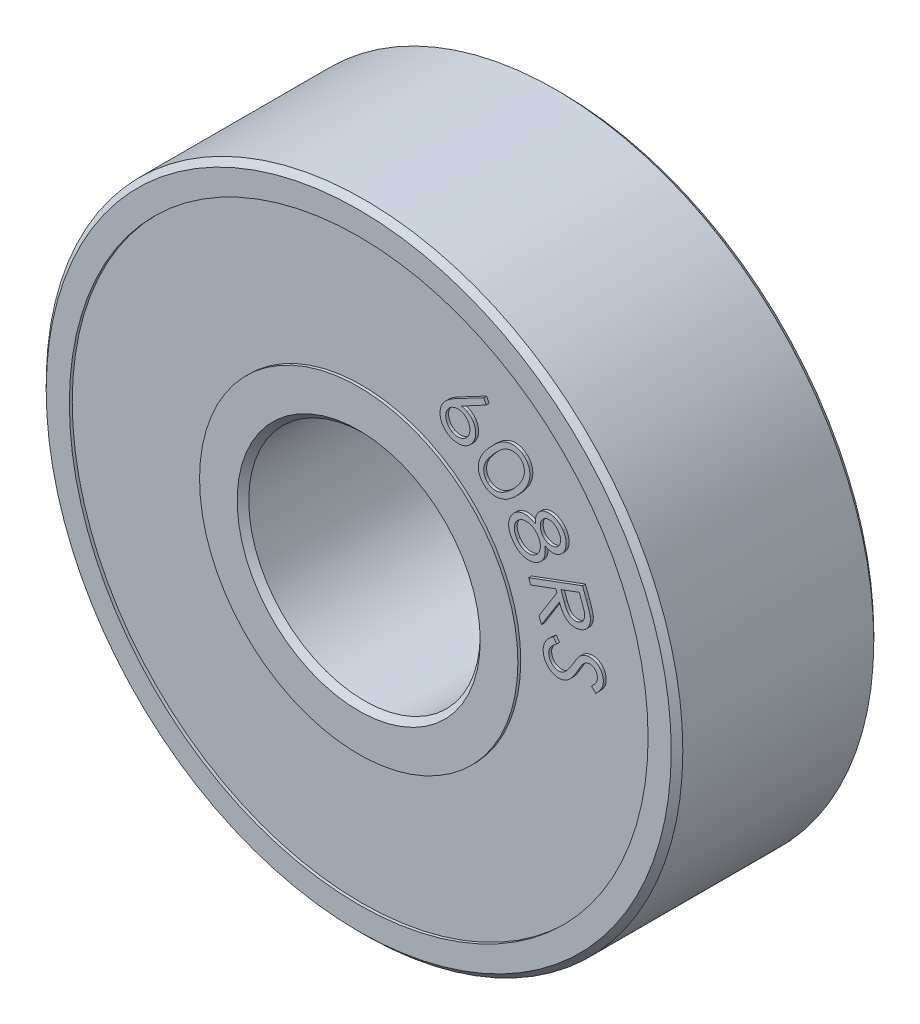
from build123d import *

# Parameters (mm, degrees)
SKETCH1_R           = 11
SKETCH1_R_2         = 4
BOSS_EXTRUDE1_DEPTH = 7
SKETCH2_R           = 10
SKETCH2_R_2         = 5.5
CUT_EXTRUDE2_DEPTH  = 0.1
CUT_EXTRUDE3_START  = -0.1
SKETCH4_R           = 10
SKETCH4_R_2         = 5.5
CUT_EXTRUDE3_DEPTH  = 0.1
CHAMFER1_SIZE       = 0.2
BOSS_EXTRUDE2_DEPTH = 0.1
BOSS_EXTRUDE3_DEPTH = 0.1


with BuildPart() as part:
    # Sketch1 → Boss-Extrude1 (new body)
    with BuildSketch(Plane.XY):
        Circle(SKETCH1_R)
        Circle(SKETCH1_R_2, mode=Mode.SUBTRACT)
    extrude(amount=BOSS_EXTRUDE1_DEPTH)

    # Sketch2 → Cut-Extrude2 (cut)
    with BuildSketch(Plane.XY):
        Circle(SKETCH2_R)
        Circle(SKETCH2_R_2, mode=Mode.SUBTRACT)
    extrude(amount=CUT_EXTRUDE2_DEPTH, mode=Mode.SUBTRACT)

    # Sketch4 → Cut-Extrude3 (cut)
    with BuildSketch(Plane.XY.offset(7).offset(CUT_EXTRUDE3_START)):
        Circle(SKETCH4_R)
        Circle(SKETCH4_R_2, mode=Mode.SUBTRACT)
    extrude(amount=CUT_EXTRUDE3_DEPTH, mode=Mode.SUBTRACT)

    # Chamfer1
    chamfer1_edges = [part.edges().sort_by_distance(p)[0] for p in [
        (-11, 0, 0),
        (-11, 0, 7),
        (-4, 0, 0),
        (-4, 0, 7),
    ]]
    chamfer(chamfer1_edges, length=CHAMFER1_SIZE)

    # Sketch6 → Boss-Extrude2 (add)
    # profile 1 of 5: a face of its own
    with BuildSketch(Plane.XY):
        with BuildLine():
            Line((8.400972236, 1.245278451), (8.276305193, 1.394913928))
            Line((8.276305193, 1.394913928), (7.532464021, 0.767266306))
            add(Edge.make_bspline(
                [(7.532464021, 0.767266306), (7.536115212, 0.785455358), (7.543243736, 0.820967356), (7.547738313, 0.873742799), (7.549524224, 0.924277554), (7.546552225, 0.957004618), (7.545093372, 0.973069213)],
                knots=[0, 0, 0, 0, 1.074256757, 2.097360688, 3.066059544, 4, 4, 4, 4], degree=3))
            add(Edge.make_bspline(
                [(7.545093372, 0.973069213), (7.54245044, 0.992194676), (7.537226117, 1.030000268), (7.521952348, 1.084467938), (7.502714647, 1.13633671), (7.477940186, 1.185183492), (7.448372314, 1.23131978), (7.413247665, 1.274364406), (7.373492942, 1.314747899), (7.328854082, 1.351336266), (7.281193069, 1.384202865), (7.23121765, 1.412439623), (7.178882399, 1.434353969), (7.125161477, 1.451980473), (7.069190551, 1.463038272), (7.011612256, 1.469547862), (6.952048797, 1.470058397), (6.912059562, 1.466490166), (6.891692774, 1.464672842)],
                knots=[0, 0, 0, 0, 1.016055127, 2.008451459, 2.972717674, 3.926662305, 4.887869431, 5.85398182, 6.848196985, 7.86833599, 8.889638818, 9.89533788, 10.885937025, 11.874134836, 12.868698438, 13.885727404, 14.923186677, 16, 16, 16, 16], degree=3))
            add(Edge.make_bspline(
                [(6.891692774, 1.464672842), (6.863982328, 1.460600979), (6.809609084, 1.452611198), (6.731946874, 1.427427197), (6.659322389, 1.394013506), (6.592435597, 1.351143024), (6.532659758, 1.299288323), (6.47981268, 1.240313883), (6.435828159, 1.173102604), (6.399903812, 1.099889549), (6.373362129, 1.021875495), (6.35737719, 0.941347221), (6.350701013, 0.85914605), (6.355366641, 0.80437568), (6.357720239, 0.7767465)],
                knots=[0, 0, 0, 0, 1.03670452, 2.034214304, 3.013873228, 3.993994889, 4.968234776, 5.939198628, 6.920020233, 7.936128887, 8.955260265, 9.965272067, 10.973571603, 12, 12, 12, 12], degree=3))
            add(Edge.make_bspline(
                [(6.357720239, 0.7767465), (6.361853404, 0.750283272), (6.370041261, 0.697859244), (6.394482684, 0.622368192), (6.427854766, 0.55092425), (6.470308622, 0.48425448), (6.520829253, 0.423431032), (6.579828989, 0.371252782), (6.645375049, 0.327024018), (6.717244438, 0.291992387), (6.793260272, 0.265782469), (6.871711933, 0.250241808), (6.951533522, 0.243200297), (7.004698891, 0.247776087), (7.031521312, 0.250084616)],
                knots=[0, 0, 0, 0, 1.011489579, 2.003775175, 2.988191405, 3.986280827, 4.984472441, 5.967838986, 6.954299535, 7.965524364, 8.982582845, 9.985654748, 10.98374417, 12, 12, 12, 12], degree=3))
            add(Edge.make_bspline(
                [(7.031521312, 0.250084616), (7.051768539, 0.253210238), (7.093150857, 0.259598544), (7.155003318, 0.276309865), (7.217408273, 0.300093715), (7.281778346, 0.329625209), (7.349355826, 0.36809922), (7.421621087, 0.416292306), (7.499591054, 0.474891308), (7.552079762, 0.51891709), (7.579723479, 0.542103721)],
                knots=[0, 0, 0, 0, 0.779736019, 1.59366437, 2.433859235, 3.320496296, 4.287978109, 5.391558782, 6.626237621, 8, 8, 8, 8], degree=3))
            Line((7.579723479, 0.542103721), (8.400972236, 1.245278451))
        make_face()
        with BuildLine():
            add(Edge.make_bspline(
                [(7.37757653, 0.905497374), (7.378878302, 0.891478916), (7.381456453, 0.863715441), (7.380834547, 0.822286855), (7.375275005, 0.781993418), (7.366894383, 0.742728999), (7.353870145, 0.704763902), (7.337121241, 0.667847412), (7.315791137, 0.632388277), (7.291276298, 0.598163888), (7.263882277, 0.566217288), (7.234140473, 0.537324535), (7.201828038, 0.512833115), (7.168023941, 0.491108972), (7.131885049, 0.4734648), (7.093628354, 0.459271932), (7.053375435, 0.448620862), (7.025549391, 0.444659658), (7.011485396, 0.442657565)],
                knots=[0, 0, 0, 0, 1.028868043, 2.037667126, 3.020428292, 3.998522581, 4.96824836, 5.948727477, 6.956770339, 7.988229293, 9.023332257, 10.029718904, 11.013110341, 11.98259034, 12.963215278, 13.946558247, 14.962137983, 16, 16, 16, 16], degree=3))
            add(Edge.make_bspline(
                [(7.011485396, 0.442657565), (6.997466914, 0.441355753), (6.969703393, 0.438777523), (6.928275151, 0.439400008), (6.887980447, 0.444957416), (6.848720701, 0.453345912), (6.810738254, 0.46634092), (6.773800258, 0.48324094), (6.738009438, 0.504202386), (6.703791398, 0.528898832), (6.671756692, 0.556210671), (6.643168742, 0.586100403), (6.617820201, 0.617640416), (6.597052379, 0.651959552), (6.578608482, 0.687651845), (6.564710919, 0.725801719), (6.55404755, 0.765757167), (6.550141423, 0.793325172), (6.548148215, 0.807392493)],
                knots=[0, 0, 0, 0, 1.030044787, 2.039997661, 3.023882838, 4.003095799, 4.973930681, 5.955531197, 6.97175552, 8.004394182, 9.040681022, 10.0482187, 11.027870628, 11.995353714, 12.979287443, 13.963755088, 14.960950952, 16, 16, 16, 16], degree=3))
            add(Edge.make_bspline(
                [(6.548148215, 0.807392493), (6.546789381, 0.821413612), (6.544094913, 0.849216437), (6.54555083, 0.890593715), (6.550277133, 0.930965868), (6.558915162, 0.9701364), (6.571723077, 1.008279241), (6.589242002, 1.044913188), (6.609613831, 1.081018535), (6.634444548, 1.115047952), (6.66157394, 1.147146991), (6.69184993, 1.175444711), (6.723654194, 1.200542279), (6.757634433, 1.222136716), (6.793738664, 1.239822906), (6.831752826, 1.253914931), (6.871737215, 1.264523228), (6.899301222, 1.268436964), (6.913366502, 1.270434054)],
                knots=[0, 0, 0, 0, 1.029833873, 2.042083239, 3.022314313, 4.001326768, 4.97196286, 5.959425701, 6.96869876, 8.001125978, 9.037200625, 10.039637513, 11.027970408, 11.998360489, 12.97990597, 13.964172033, 14.96116371, 16, 16, 16, 16], degree=3))
            add(Edge.make_bspline(
                [(6.913366502, 1.270434054), (6.927517926, 1.271841808), (6.955450063, 1.274620438), (6.997070449, 1.273031724), (7.037682316, 1.268672663), (7.076922897, 1.259399276), (7.115057791, 1.246481413), (7.152085992, 1.229943441), (7.187768865, 1.20895526), (7.221847339, 1.184387898), (7.253848966, 1.157050658), (7.282635633, 1.127153475), (7.307661345, 1.095187045), (7.329285495, 1.061235537), (7.346963682, 1.025123568), (7.361057867, 0.987111494), (7.371665583, 0.947126544), (7.375579399, 0.919562615), (7.37757653, 0.905497374)],
                knots=[0, 0, 0, 0, 1.03801315, 2.048834464, 3.03683391, 4.018790489, 4.988057235, 5.975767468, 6.976552279, 8.007522978, 9.04213596, 10.04804622, 11.034984804, 12.004005886, 12.984166631, 13.96704412, 14.96262927, 16, 16, 16, 16], degree=3))
        make_face(mode=Mode.SUBTRACT)
    # profile 2 of 5: a face of its own
    with BuildSketch(Plane.XY):
        with BuildLine():
            add(Edge.make_bspline(
                [(7.217844675, 1.9497176), (7.247601197, 1.960848788), (7.305448737, 1.982488138), (7.387951693, 2.018038459), (7.464956482, 2.052691346), (7.535308104, 2.089139884), (7.600064918, 2.125166912), (7.658223828, 2.162633048), (7.710805032, 2.199690363), (7.75689437, 2.238510615), (7.798277662, 2.277604364), (7.835412484, 2.317661071), (7.869491044, 2.357913553), (7.898689226, 2.39991298), (7.925065079, 2.442247266), (7.946936898, 2.485931111), (7.965279617, 2.530387932), (7.979874465, 2.575438126), (7.99015895, 2.621081263), (7.997985714, 2.666496843), (8.001179253, 2.711867723), (8.001435023, 2.757106914), (7.997282963, 2.802224099), (7.989930157, 2.847351246), (7.978918029, 2.892287517), (7.968871168, 2.921662087), (7.96381276, 2.936451637)],
                knots=[0, 0, 0, 0, 1.644047404, 3.196075707, 4.648695921, 6.013339179, 7.295680536, 8.482357441, 9.592488876, 10.622456575, 11.59823647, 12.537086883, 13.448411439, 14.325162375, 15.182016501, 16.027928391, 16.850184533, 17.669326333, 18.475297982, 19.270017618, 20.052011222, 20.826453901, 21.609058199, 22.393796184, 23.191306266, 24, 24, 24, 24], degree=3))
            add(Edge.make_bspline(
                [(7.96381276, 2.936451637), (7.957966333, 2.951223697), (7.946347976, 2.98057959), (7.924923424, 3.022475867), (7.90096365, 3.062249177), (7.874133938, 3.099596232), (7.844635173, 3.134861233), (7.811663984, 3.167223652), (7.776442617, 3.198158998), (7.737937072, 3.226099138), (7.697170103, 3.251856746), (7.653356803, 3.273889379), (7.607376795, 3.293427543), (7.55842685, 3.309193079), (7.507268002, 3.322359161), (7.453237514, 3.33151791), (7.396883742, 3.338623548), (7.337726297, 3.341749765), (7.275715682, 3.341866474), (7.210376974, 3.336848522), (7.141547408, 3.327766021), (7.06923813, 3.314776579), (6.993441821, 3.297463978), (6.914405279, 3.275064531), (6.831646054, 3.249080568), (6.775788291, 3.229146015), (6.747150249, 3.218925653)],
                knots=[0, 0, 0, 0, 0.815654126, 1.620915111, 2.413720351, 3.198741545, 3.980789903, 4.772080142, 5.56953114, 6.386539911, 7.213168292, 8.043743634, 8.902727641, 9.776835338, 10.682745829, 11.613786495, 12.589737535, 13.598852571, 14.6546617, 15.772831674, 16.961975231, 18.219642292, 19.545219478, 20.953820831, 22.438236669, 24, 24, 24, 24], degree=3))
            add(Edge.make_bspline(
                [(6.747150249, 3.218925653), (6.718869076, 3.208091743), (6.663647493, 3.186937542), (6.584274376, 3.153045475), (6.510274768, 3.118189012), (6.441503134, 3.082673411), (6.378182285, 3.04578965), (6.320265901, 3.00793656), (6.268068603, 2.968905636), (6.220819412, 2.929215763), (6.178968949, 2.888074854), (6.140321713, 2.846915882), (6.106385927, 2.804360789), (6.075778539, 2.7612533), (6.049099647, 2.717398568), (6.02654084, 2.672545211), (6.007932079, 2.626944375), (5.993287979, 2.580637805), (5.982799671, 2.533991032), (5.975383292, 2.487476754), (5.971875478, 2.44099774), (5.972001007, 2.394715089), (5.975944105, 2.348618583), (5.983646594, 2.302751341), (5.994712278, 2.25695701), (6.00518794, 2.227147667), (6.01045303, 2.212165429)],
                knots=[0, 0, 0, 0, 1.55711506, 3.040409836, 4.436436317, 5.762268015, 7.018880979, 8.202771049, 9.317744006, 10.368377284, 11.372823969, 12.333603001, 13.269622697, 14.168955615, 15.050576255, 15.906277554, 16.74775414, 17.580443395, 18.400350256, 19.203993271, 20.000298002, 20.794260351, 21.58133346, 22.376245454, 23.183897564, 24, 24, 24, 24], degree=3))
            add(Edge.make_bspline(
                [(6.01045303, 2.212165429), (6.016085478, 2.197577574), (6.027263927, 2.168625756), (6.048727964, 2.127648555), (6.072046052, 2.088475805), (6.098209456, 2.051588745), (6.127773673, 2.017653146), (6.159288834, 1.98531081), (6.194447222, 1.956145591), (6.231564696, 1.92832786), (6.27185942, 1.903885046), (6.314223782, 1.881967215), (6.359317327, 1.863816812), (6.406698697, 1.848642602), (6.456521444, 1.836258293), (6.508813198, 1.82720407), (6.563507857, 1.821547841), (6.620882363, 1.818335183), (6.681513473, 1.819726224), (6.746088981, 1.824668118), (6.814726109, 1.834731328), (6.887378484, 1.849362654), (6.964353325, 1.867530822), (7.045132054, 1.891021493), (7.130488176, 1.917824227), (7.188136763, 1.938871407), (7.217844675, 1.9497176)],
                knots=[0, 0, 0, 0, 0.809610891, 1.606795977, 2.392852221, 3.17091898, 3.945902809, 4.722861122, 5.507789705, 6.310123381, 7.124157602, 7.946530608, 8.779001203, 9.639387347, 10.522592956, 11.436909835, 12.386571613, 13.370333528, 14.412217926, 15.526343133, 16.7241361, 18.003813114, 19.365478291, 20.820630887, 22.361583156, 24, 24, 24, 24], degree=3))
        make_face()
        with BuildLine():
            add(Edge.make_bspline(
                [(7.148708371, 2.123749713), (7.123140176, 2.114521964), (7.073684958, 2.096673212), (7.001340585, 2.072358803), (6.932917357, 2.052306561), (6.86871824, 2.035650947), (6.808662019, 2.021927996), (6.752686614, 2.01247473), (6.700876006, 2.005656475), (6.652785781, 2.003591152), (6.607758719, 2.003716764), (6.56486304, 2.006527211), (6.523880933, 2.01269422), (6.484531373, 2.020727814), (6.446915114, 2.031004973), (6.411399056, 2.044779985), (6.377536391, 2.060678416), (6.335416942, 2.084772483), (6.288105269, 2.119454548), (6.240135611, 2.167522291), (6.201815749, 2.221350912), (6.184758176, 2.261168188), (6.176228738, 2.281078347)],
                knots=[0, 0, 0, 0, 1.481115136, 2.864843381, 4.157831457, 5.365199567, 6.478540113, 7.513091299, 8.457610459, 9.323664284, 10.133477016, 10.910453846, 11.663446564, 12.389736228, 13.098125597, 13.785151181, 14.462669584, 15.134734324, 16.426821135, 17.645169215, 18.822494663, 20, 20, 20, 20], degree=3))
            add(Edge.make_bspline(
                [(6.176228738, 2.281078347), (6.16970082, 2.301806204), (6.1566719, 2.343176458), (6.150220604, 2.408736848), (6.155109869, 2.475654653), (6.167502729, 2.531860183), (6.183281296, 2.576662953), (6.198291755, 2.610296514), (6.216927539, 2.643065609), (6.23850455, 2.675292812), (6.262991532, 2.706958574), (6.291023953, 2.737654221), (6.321754586, 2.767991509), (6.344349603, 2.786837011), (6.355840684, 2.796421213)],
                knots=[0, 0, 0, 0, 1.336339731, 2.667169702, 4.028860611, 5.45746449, 6.198511, 6.95318574, 7.723755721, 8.518424657, 9.341517181, 10.187693627, 11.07832069, 12, 12, 12, 12], degree=3))
            add(Edge.make_bspline(
                [(6.355840684, 2.796421213), (6.37073323, 2.808203092), (6.401093683, 2.832222034), (6.449338497, 2.866161938), (6.500979971, 2.898770113), (6.556053457, 2.929928173), (6.614105388, 2.960511445), (6.675767773, 2.989315111), (6.740541346, 3.01714577), (6.785357924, 3.034063185), (6.808161994, 3.042671293)],
                knots=[0, 0, 0, 0, 0.880803688, 1.795636602, 2.734876522, 3.712972154, 4.730382519, 5.777996276, 6.869375336, 8, 8, 8, 8], degree=3))
            add(Edge.make_bspline(
                [(6.808161994, 3.042671293), (6.831096069, 3.050864582), (6.875960943, 3.066892735), (6.942320648, 3.088823559), (7.0064871, 3.106711554), (7.067917881, 3.122186771), (7.12697095, 3.134168704), (7.183554408, 3.14332571), (7.237769983, 3.149276509), (7.289492613, 3.151743825), (7.338817567, 3.151984786), (7.385710258, 3.148664904), (7.430276464, 3.144032566), (7.472220979, 3.135713805), (7.511851642, 3.125696779), (7.548805179, 3.112065462), (7.583581353, 3.096550442), (7.625726703, 3.072292992), (7.672439617, 3.037363241), (7.720812877, 2.990108979), (7.758699613, 2.936448868), (7.775803524, 2.896989537), (7.784297782, 2.877392983)],
                knots=[0, 0, 0, 0, 1.327111759, 2.59616751, 3.807379649, 4.95623126, 6.047589216, 7.089774014, 8.078876303, 9.017765606, 9.910508316, 10.764782142, 11.578413162, 12.350119774, 13.092978708, 13.803367589, 14.493602966, 15.165723257, 16.449198791, 17.660935511, 18.838358274, 20, 20, 20, 20], degree=3))
            add(Edge.make_bspline(
                [(7.784297782, 2.877392983), (7.790691665, 2.856570904), (7.803490997, 2.814889078), (7.810117037, 2.748906948), (7.804420697, 2.681219731), (7.79130876, 2.624450995), (7.775756612, 2.57880844), (7.760159897, 2.545054893), (7.741938768, 2.511850644), (7.7207167, 2.479260506), (7.695982958, 2.44772422), (7.668479699, 2.416706136), (7.638113342, 2.386349719), (7.604069698, 2.356779037), (7.566094556, 2.327237966), (7.522644604, 2.298195155), (7.473840041, 2.269053416), (7.419408673, 2.239950449), (7.35953244, 2.210941168), (7.294346104, 2.181278561), (7.22343197, 2.152310018), (7.174117339, 2.133461342), (7.148708371, 2.123749713)],
                knots=[0, 0, 0, 0, 1.18408996, 2.37032202, 3.583948465, 4.868314319, 5.533148328, 6.206676446, 6.890182147, 7.594458554, 8.321861185, 9.070618294, 9.850955435, 10.658243679, 11.524779095, 12.469261939, 13.502274401, 14.619247699, 15.82931713, 17.124998841, 18.518678673, 20, 20, 20, 20], degree=3))
        make_face(mode=Mode.SUBTRACT)
    # profile 3 of 5: a face of its own
    with BuildSketch(Plane.XY):
        with BuildLine():
            add(Edge.make_bspline(
                [(6.100909524, 4.45822632), (6.084824097, 4.46718189), (6.053420603, 4.484665804), (6.00599333, 4.507211355), (5.960293695, 4.527255859), (5.915445037, 4.542636814), (5.87208471, 4.555634508), (5.829611762, 4.564029665), (5.788608667, 4.569829874), (5.748692884, 4.571739029), (5.709901832, 4.569931483), (5.671743139, 4.566408491), (5.634475492, 4.558563081), (5.597468713, 4.549412103), (5.561349122, 4.535962173), (5.525522063, 4.520557061), (5.490462944, 4.501783377), (5.468040875, 4.487322912), (5.456700573, 4.480009312)],
                knots=[0, 0, 0, 0, 1.290890309, 2.520198396, 3.681805585, 4.788490099, 5.843551436, 6.853927339, 7.821726867, 8.74603337, 9.651448064, 10.544029729, 11.429902383, 12.319727641, 13.215057227, 14.129151139, 15.053789794, 16, 16, 16, 16], degree=3))
            add(Edge.make_bspline(
                [(5.456700573, 4.480009312), (5.441258421, 4.469028145), (5.410673315, 4.447278575), (5.368389031, 4.410797636), (5.330447999, 4.371029161), (5.296481188, 4.328424243), (5.266511794, 4.282722066), (5.240526988, 4.234101091), (5.218998186, 4.182334395), (5.207812547, 4.146449926), (5.202153174, 4.128294182)],
                knots=[0, 0, 0, 0, 1.02459754, 2.029343036, 3.015319328, 3.993724459, 4.972689464, 5.967517749, 6.971665777, 8, 8, 8, 8], degree=3))
            add(Edge.make_bspline(
                [(5.202153174, 4.128294182), (5.196594911, 4.105621951), (5.185517543, 4.060437212), (5.179222918, 3.990916876), (5.181175223, 3.921081713), (5.19205426, 3.85098109), (5.210494773, 3.78048276), (5.237615485, 3.709690838), (5.273289639, 3.63874551), (5.302484212, 3.593032238), (5.317458127, 3.569585872)],
                knots=[0, 0, 0, 0, 0.94927729, 1.891867025, 2.831441269, 3.787189233, 4.773456595, 5.792841766, 6.867947176, 8, 8, 8, 8], degree=3))
            add(Edge.make_bspline(
                [(5.317458127, 3.569585872), (5.332716346, 3.547586706), (5.362416605, 3.504765134), (5.412412927, 3.447364909), (5.463874456, 3.396823243), (5.517642939, 3.353832696), (5.573615146, 3.318230059), (5.631639723, 3.289934077), (5.692122273, 3.269637377), (5.754045507, 3.257206498), (5.815946058, 3.250428305), (5.876410801, 3.249182914), (5.935035464, 3.252414407), (5.991487379, 3.261501676), (6.046050161, 3.27531176), (6.098506065, 3.294236289), (6.149044755, 3.318365368), (6.180632754, 3.338318035), (6.196541327, 3.348366739)],
                knots=[0, 0, 0, 0, 1.265189782, 2.462703114, 3.593198436, 4.67234407, 5.711673085, 6.724080211, 7.71757927, 8.719632106, 9.70506986, 10.658584755, 11.576575664, 12.477685061, 13.358041525, 14.234425087, 15.110808649, 16, 16, 16, 16], degree=3))
            add(Edge.make_bspline(
                [(6.196541327, 3.348366739), (6.207715103, 3.356254143), (6.230019412, 3.371998425), (6.261211673, 3.397762016), (6.289622119, 3.425815175), (6.316003318, 3.454962068), (6.339531463, 3.486563693), (6.361453812, 3.519137599), (6.379732131, 3.554309938), (6.396612552, 3.590621056), (6.410637166, 3.629476834), (6.422008557, 3.670639084), (6.429468467, 3.71471131), (6.435325688, 3.761021731), (6.437670256, 3.810099801), (6.437669149, 3.861668395), (6.434067523, 3.915810297), (6.429936013, 3.95261859), (6.427823286, 3.971441218)],
                knots=[0, 0, 0, 0, 0.931334836, 1.859065266, 2.751202648, 3.648748233, 4.533436264, 5.43245535, 6.319384756, 7.229651734, 8.158095254, 9.129430785, 10.133761898, 11.19951572, 12.306952597, 13.477470392, 14.710056011, 16, 16, 16, 16], degree=3))
            add(Edge.make_bspline(
                [(6.427823286, 3.971441218), (6.451434344, 3.959371399), (6.497216839, 3.935967686), (6.568207479, 3.911435038), (6.637763646, 3.896578982), (6.705785536, 3.892320979), (6.771597715, 3.89760613), (6.834357461, 3.911972646), (6.894122445, 3.934613083), (6.930167625, 3.956675933), (6.948292995, 3.967770268)],
                knots=[0, 0, 0, 0, 1.159116483, 2.247558892, 3.275615725, 4.262372356, 5.218835671, 6.154236364, 7.07185513, 8, 8, 8, 8], degree=3))
            add(Edge.make_bspline(
                [(6.948292995, 3.967770268), (6.965743524, 3.98064845), (7.000845612, 4.006553169), (7.046096029, 4.055298875), (7.085033565, 4.111527144), (7.117340613, 4.174386387), (7.142788616, 4.242010018), (7.158292599, 4.313453379), (7.164055255, 4.387393165), (7.159647497, 4.462838138), (7.146462587, 4.5381414), (7.124305501, 4.611755876), (7.092807509, 4.682812171), (7.065248809, 4.726967769), (7.051305871, 4.749307674)],
                knots=[0, 0, 0, 0, 0.892779067, 1.795842916, 2.727080536, 3.70581188, 4.703144711, 5.698163754, 6.710047702, 7.752069251, 8.806330382, 9.855631886, 10.91508709, 12, 12, 12, 12], degree=3))
            add(Edge.make_bspline(
                [(7.051305871, 4.749307674), (7.03638776, 4.770188204), (7.00688333, 4.811484862), (6.95374208, 4.865461581), (6.895174283, 4.912315737), (6.831137657, 4.950785555), (6.763716822, 4.9810881), (6.694193534, 5.002167248), (6.623305516, 5.013797431), (6.551942109, 5.015230041), (6.482097081, 5.007487554), (6.415067557, 4.991990286), (6.35219684, 4.966642929), (6.31395224, 4.943320945), (6.29483948, 4.931665771)],
                knots=[0, 0, 0, 0, 1.068771019, 2.113771646, 3.146516798, 4.18939315, 5.220229497, 6.221594843, 7.210477599, 8.206485729, 9.188317762, 10.134173663, 11.067552274, 12, 12, 12, 12], degree=3))
            add(Edge.make_bspline(
                [(6.29483948, 4.931665771), (6.276927998, 4.918695458), (6.241857259, 4.893299543), (6.197058277, 4.846815042), (6.160703315, 4.794936011), (6.131996241, 4.737809779), (6.112038588, 4.675301211), (6.099919988, 4.607583866), (6.095773694, 4.53449427), (6.099157971, 4.484237174), (6.100909524, 4.45822632)],
                knots=[0, 0, 0, 0, 0.981875121, 1.922514633, 2.854567088, 3.789622669, 4.754286786, 5.76174218, 6.841576559, 8, 8, 8, 8], degree=3))
        make_face()
        with BuildLine():
            add(Edge.make_bspline(
                [(6.895097255, 4.633967194), (6.902299452, 4.622683648), (6.91648648, 4.600457099), (6.934470288, 4.565961184), (6.948404421, 4.530895686), (6.959321954, 4.495947478), (6.966314336, 4.460519283), (6.969896666, 4.424996951), (6.970148274, 4.389131875), (6.966632604, 4.353536861), (6.960339822, 4.31890744), (6.950792858, 4.286119612), (6.938837357, 4.255335054), (6.923653372, 4.226677358), (6.905443071, 4.200341186), (6.884625481, 4.175997729), (6.860831692, 4.15397635), (6.84321287, 4.14116508), (6.834297385, 4.134682315)],
                knots=[0, 0, 0, 0, 1.147797877, 2.260954539, 3.330167184, 4.38025149, 5.396817843, 6.421610434, 7.438370352, 8.467442645, 9.485040915, 10.452679454, 11.391973248, 12.312859485, 13.227240642, 14.132754951, 15.055135845, 16, 16, 16, 16], degree=3))
            add(Edge.make_bspline(
                [(6.834297385, 4.134682315), (6.825078895, 4.128904551), (6.806648177, 4.11735295), (6.776750732, 4.103931573), (6.745372969, 4.094459092), (6.712802292, 4.087275619), (6.678815248, 4.084687294), (6.643510931, 4.084961247), (6.60693048, 4.089341141), (6.569499768, 4.096435848), (6.532398296, 4.106985438), (6.49667973, 4.119909394), (6.463452435, 4.136806709), (6.432223715, 4.156049118), (6.402893706, 4.177834948), (6.376059833, 4.20303145), (6.350942178, 4.230752499), (6.336531005, 4.251447611), (6.329259826, 4.26188936)],
                knots=[0, 0, 0, 0, 0.908844192, 1.81707094, 2.729132775, 3.645761934, 4.599514883, 5.571907187, 6.593318126, 7.675011067, 8.753876802, 9.815092739, 10.84525358, 11.863975947, 12.879511735, 13.893573417, 14.937199413, 16, 16, 16, 16], degree=3))
            add(Edge.make_bspline(
                [(6.329259826, 4.26188936), (6.320593448, 4.275717355), (6.303287809, 4.30333008), (6.284828238, 4.348538292), (6.271492591, 4.395744731), (6.264026209, 4.444501478), (6.262942023, 4.493838736), (6.268326029, 4.542278751), (6.279969604, 4.58936238), (6.298591405, 4.633828877), (6.321215294, 4.675381013), (6.348528117, 4.711942539), (6.378707392, 4.744185806), (6.401949883, 4.761289362), (6.413485435, 4.76977808)],
                knots=[0, 0, 0, 0, 1.029778083, 2.056334151, 3.072742447, 4.125103068, 5.164692881, 6.18264204, 7.197261409, 8.21856438, 9.221531217, 10.179595353, 11.096509409, 12, 12, 12, 12], degree=3))
            add(Edge.make_bspline(
                [(6.413485435, 4.76977808), (6.421972266, 4.77511434), (6.43878677, 4.785686786), (6.465922508, 4.798149476), (6.494070148, 4.80787278), (6.523564046, 4.814569118), (6.554134731, 4.818533558), (6.586000326, 4.819355791), (6.618971256, 4.817582637), (6.652879365, 4.812704264), (6.68707317, 4.805114855), (6.720440211, 4.792743421), (6.752263825, 4.775943766), (6.783469459, 4.755943981), (6.813352544, 4.731458448), (6.841865467, 4.702675323), (6.869483908, 4.670074426), (6.886387457, 4.64624543), (6.895097255, 4.633967194)],
                knots=[0, 0, 0, 0, 0.860567069, 1.704995385, 2.558804371, 3.415153889, 4.298967395, 5.203031682, 6.150124742, 7.132495547, 8.143595732, 9.153914339, 10.17923786, 11.230179396, 12.333615959, 13.490750709, 14.707072956, 16, 16, 16, 16], degree=3))
        make_face(mode=Mode.SUBTRACT)
        with BuildLine():
            add(Edge.make_bspline(
                [(6.177714551, 4.163253821), (6.186916732, 4.14914149), (6.205015261, 4.12138585), (6.226096795, 4.077076456), (6.243842938, 4.032907803), (6.256415205, 3.987770624), (6.264748147, 3.942069149), (6.267694233, 3.89556891), (6.266476516, 3.848582605), (6.260330142, 3.801726672), (6.250938558, 3.755676674), (6.236707071, 3.712180149), (6.220025869, 3.671127713), (6.198559858, 3.633574936), (6.174620957, 3.598182405), (6.145945857, 3.566494454), (6.114618895, 3.536724158), (6.090897438, 3.520042561), (6.078872527, 3.511586305)],
                knots=[0, 0, 0, 0, 1.103096915, 2.169532516, 3.209705979, 4.22005898, 5.235178716, 6.249127762, 7.268541052, 8.31114268, 9.343069619, 10.344088993, 11.307028603, 12.241865975, 13.174241085, 14.101672058, 15.037697202, 16, 16, 16, 16], degree=3))
            add(Edge.make_bspline(
                [(6.078872527, 3.511586305), (6.063456531, 3.502075407), (6.032663681, 3.48307776), (5.981878303, 3.463107866), (5.928406544, 3.450070213), (5.872881505, 3.443885996), (5.816414483, 3.44503273), (5.760738615, 3.455454951), (5.706283901, 3.473239646), (5.65368604, 3.499205267), (5.603551995, 3.532948813), (5.556176049, 3.573774771), (5.511736644, 3.621925439), (5.485916451, 3.658379486), (5.472641162, 3.677122104)],
                knots=[0, 0, 0, 0, 0.926109246, 1.849867156, 2.780058085, 3.737943589, 4.703270699, 5.660960876, 6.627667837, 7.628486545, 8.654526651, 9.714225142, 10.824783286, 12, 12, 12, 12], degree=3))
            add(Edge.make_bspline(
                [(5.472641162, 3.677122104), (5.462945177, 3.692052359), (5.444012901, 3.721205014), (5.421068479, 3.766739124), (5.402863603, 3.812147115), (5.389371952, 3.85730258), (5.380363443, 3.902486174), (5.377372276, 3.947650127), (5.378742277, 3.992739602), (5.384958842, 4.037240851), (5.395229639, 4.080444758), (5.40944556, 4.121459918), (5.426850973, 4.159999764), (5.447581336, 4.195904176), (5.471620368, 4.229145996), (5.498901095, 4.259853949), (5.52993939, 4.28770799), (5.552731566, 4.303992869), (5.564291525, 4.312252394)],
                knots=[0, 0, 0, 0, 1.19035752, 2.32427924, 3.40484362, 4.459799014, 5.473418872, 6.48040078, 7.481219341, 8.486773131, 9.481309882, 10.447796045, 11.386669185, 12.306601008, 13.216804754, 14.126789189, 15.049926509, 16, 16, 16, 16], degree=3))
            add(Edge.make_bspline(
                [(5.564291525, 4.312252394), (5.575966799, 4.319492498), (5.599055901, 4.333810577), (5.63589621, 4.351082879), (5.67422085, 4.364234322), (5.714168915, 4.372380976), (5.755385645, 4.377062249), (5.798007048, 4.377385341), (5.841993748, 4.37308169), (5.886796268, 4.365214527), (5.931039897, 4.352932328), (5.973768373, 4.337640524), (6.01363711, 4.317499357), (6.051506196, 4.29443208), (6.086948257, 4.267265705), (6.119915659, 4.236321495), (6.150651231, 4.201721034), (6.168601765, 4.176206536), (6.177714551, 4.163253821)],
                knots=[0, 0, 0, 0, 0.942671861, 1.864234432, 2.78725575, 3.718123832, 4.657802721, 5.631928245, 6.638488188, 7.688830978, 8.751153965, 9.788000563, 10.799352584, 11.812407604, 12.828984143, 13.859322421, 14.913261601, 16, 16, 16, 16], degree=3))
        make_face(mode=Mode.SUBTRACT)
    # profile 4 of 5: a face of its own
    with BuildSketch(Plane.XY):
        with BuildLine():
            Line((6.064730841, 5.877530022), (5.771171561, 6.140427656))
            add(Edge.make_bspline(
                [(5.771171561, 6.140427656), (5.75141203, 6.157897649), (5.713527729, 6.191392294), (5.658875923, 6.239150305), (5.608323351, 6.281492002), (5.56234863, 6.318813204), (5.520984362, 6.351202752), (5.483649149, 6.378176611), (5.450906789, 6.400571132), (5.429893733, 6.412841716), (5.420342175, 6.418419353)],
                knots=[0, 0, 0, 0, 1.412057353, 2.707291396, 3.885529576, 4.942173001, 5.877591643, 6.697605354, 7.407991967, 8, 8, 8, 8], degree=3))
            add(Edge.make_bspline(
                [(5.420342175, 6.418419353), (5.407217972, 6.42538899), (5.381314132, 6.439145282), (5.341016112, 6.455692319), (5.300318889, 6.468574016), (5.259302906, 6.478396748), (5.217742323, 6.484206183), (5.175827931, 6.48703893), (5.133455633, 6.485972341), (5.091086721, 6.481349404), (5.049121628, 6.473084585), (5.008113001, 6.461494995), (4.968489937, 6.445848313), (4.930507658, 6.426006448), (4.89335508, 6.403115199), (4.857739322, 6.376091713), (4.823195984, 6.345654804), (4.802030961, 6.322894748), (4.791242682, 6.311293445)],
                knots=[0, 0, 0, 0, 1.028906493, 2.030799975, 3.012370888, 3.983775257, 4.948593757, 5.915892742, 6.890814792, 7.88067721, 8.864816829, 9.850346846, 10.828861394, 11.809865416, 12.815340146, 13.848190017, 14.9031749, 16, 16, 16, 16], degree=3))
            add(Edge.make_bspline(
                [(4.791242682, 6.311293445), (4.774317621, 6.291294225), (4.741285778, 6.25226269), (4.703072479, 6.186949185), (4.674510797, 6.119424431), (4.656531576, 6.049435485), (4.649765764, 5.978112445), (4.653975845, 5.906397944), (4.669264676, 5.834866234), (4.691091827, 5.776018332), (4.715032596, 5.729387116), (4.736298733, 5.692768184), (4.76194001, 5.655757821), (4.791269415, 5.617778893), (4.823997876, 5.578732883), (4.860924947, 5.53906836), (4.901394893, 5.498604967), (4.930264586, 5.471987048), (4.945026056, 5.458376941)],
                knots=[0, 0, 0, 0, 1.274379708, 2.487146801, 3.66951478, 4.836894035, 5.992959142, 7.146054476, 8.323021888, 9.544397366, 10.190911179, 10.87530638, 11.605921725, 12.382541062, 13.212618153, 14.08707465, 15.021895029, 16, 16, 16, 16], degree=3))
            Line((4.945026056, 5.458376941), (3.800538058, 5.247297956))
            Line((3.800538058, 5.247297956), (3.983256482, 5.083911778))
            Line((3.983256482, 5.083911778), (5.12646253, 5.295656554))
            Line((5.12646253, 5.295656554), (5.210886017, 5.220257605))
            Line((5.210886017, 5.220257605), (4.596748833, 4.534402264))
            Line((4.596748833, 4.534402264), (4.743771185, 4.402576973))
            Line((4.743771185, 4.402576973), (6.064730841, 5.877530022))
        make_face()
        with BuildLine():
            Line((5.788453149, 5.864629335), (5.339475567, 5.363701633))
            Line((5.339475567, 5.363701633), (5.083902681, 5.588840476))
            add(Edge.make_bspline(
                [(5.083902681, 5.588840476), (5.072033237, 5.599561272), (5.049110328, 5.620265851), (5.017219354, 5.651441759), (4.988259598, 5.681067923), (4.962666292, 5.709679668), (4.93979525, 5.736859252), (4.920441331, 5.76289577), (4.904180554, 5.787587043), (4.886894987, 5.818496123), (4.871462375, 5.857371942), (4.859287541, 5.904599101), (4.855828178, 5.952726143), (4.860011924, 6.000797271), (4.870890282, 6.047926885), (4.888700636, 6.092988573), (4.913503625, 6.135353308), (4.934335226, 6.160800003), (4.944936257, 6.173749619)],
                knots=[0, 0, 0, 0, 1.120063846, 2.163127658, 3.122897825, 4.020985056, 4.851090924, 5.609841453, 6.29165219, 6.9204663, 8.087012728, 9.210040536, 10.323681586, 11.448110649, 12.57808865, 13.699362427, 14.829224296, 16, 16, 16, 16], degree=3))
            add(Edge.make_bspline(
                [(4.944936257, 6.173749619), (4.956265943, 6.18545901), (4.978634937, 6.20857768), (5.017620439, 6.236773106), (5.06013881, 6.258480991), (5.105441269, 6.27385054), (5.152125311, 6.282567814), (5.198811877, 6.284629834), (5.244780399, 6.279063854), (5.28233524, 6.267892404), (5.313121043, 6.255481905), (5.337916147, 6.241974922), (5.36512863, 6.226126216), (5.394198418, 6.20673049), (5.424810059, 6.183543121), (5.457846553, 6.158006542), (5.492570374, 6.128828062), (5.516139197, 6.10812999), (5.528424305, 6.097341243)],
                knots=[0, 0, 0, 0, 1.163014941, 2.296221835, 3.420303817, 4.564515892, 5.70381879, 6.804343663, 7.892710427, 8.997203252, 9.595302894, 10.262548919, 11.012922722, 11.846553298, 12.758501451, 13.757673048, 14.831200435, 16, 16, 16, 16], degree=3))
            Line((5.528424305, 6.097341243), (5.788453149, 5.864629335))
        make_face(mode=Mode.SUBTRACT)
    # profile 5 of 5: a face of its own
    with BuildSketch(Plane.XY):
        with BuildLine():
            Line((3.817684569, 5.704926025), (3.717176117, 5.874276705))
            add(Edge.make_bspline(
                [(3.717176117, 5.874276705), (3.691903436, 5.858446503), (3.643582118, 5.828179185), (3.5700465, 5.791815897), (3.500012116, 5.764813955), (3.433033572, 5.74818749), (3.369318894, 5.740366602), (3.308850726, 5.744027386), (3.251103872, 5.756087041), (3.216271371, 5.7729446), (3.198841337, 5.78138005)],
                knots=[0, 0, 0, 0, 1.293261597, 2.472713773, 3.55377161, 4.5434551, 5.460861921, 6.326596839, 7.16263625, 8, 8, 8, 8], degree=3))
            add(Edge.make_bspline(
                [(3.198841337, 5.78138005), (3.184637757, 5.789566445), (3.156435799, 5.805820966), (3.118622599, 5.836787191), (3.084434428, 5.871531062), (3.055071218, 5.910546504), (3.030812095, 5.951990438), (3.013097058, 5.995281276), (3.001264539, 6.039299726), (2.996305998, 6.084142942), (2.997960936, 6.128630237), (3.004184733, 6.171936336), (3.016853477, 6.213582892), (3.029432825, 6.239469337), (3.035787639, 6.252546608)],
                knots=[0, 0, 0, 0, 1.062882551, 2.110409507, 3.161376157, 4.221531683, 5.272498333, 6.270738718, 7.249660421, 8.223036216, 9.187721675, 10.133237854, 11.056952225, 12, 12, 12, 12], degree=3))
            add(Edge.make_bspline(
                [(3.035787639, 6.252546608), (3.044452056, 6.266714939), (3.062041458, 6.295477687), (3.097285468, 6.333057246), (3.139437711, 6.366359759), (3.171520086, 6.383718278), (3.188135755, 6.392708367)],
                knots=[0, 0, 0, 0, 0.946148064, 1.920749854, 2.923142913, 4, 4, 4, 4], degree=3))
            add(Edge.make_bspline(
                [(3.188135755, 6.392708367), (3.200945076, 6.398812595), (3.227829667, 6.411624335), (3.271815821, 6.428167026), (3.320722595, 6.443795505), (3.374454961, 6.459752015), (3.433468432, 6.473769582), (3.497363902, 6.487690834), (3.566350458, 6.500234911), (3.614056175, 6.507979831), (3.638723487, 6.511984516)],
                knots=[0, 0, 0, 0, 0.727825664, 1.527582685, 2.408664553, 3.362379031, 4.402751929, 5.520057329, 6.717689987, 8, 8, 8, 8], degree=3))
            add(Edge.make_bspline(
                [(3.638723487, 6.511984516), (3.663362382, 6.515751802), (3.710416105, 6.522946314), (3.777294216, 6.53530369), (3.837738696, 6.546106276), (3.891140032, 6.558294029), (3.938161274, 6.569006589), (3.978159776, 6.580579477), (4.011674627, 6.591540918), (4.031224466, 6.600187503), (4.040044961, 6.604088669)],
                knots=[0, 0, 0, 0, 1.44918096, 2.76754933, 3.95443019, 5.01871464, 5.952153851, 6.757715182, 7.439505986, 8, 8, 8, 8], degree=3))
            add(Edge.make_bspline(
                [(4.040044961, 6.604088669), (4.052940751, 6.610454318), (4.078426699, 6.62303475), (4.114739441, 6.644355529), (4.148242524, 6.668508869), (4.179336465, 6.694634464), (4.207828215, 6.723019228), (4.233745535, 6.75364559), (4.256938152, 6.786581625), (4.270420897, 6.809973485), (4.277164251, 6.821672851)],
                knots=[0, 0, 0, 0, 1.053352591, 2.081740564, 3.080382292, 4.07542357, 5.053927764, 6.022848426, 7.011133769, 8, 8, 8, 8], degree=3))
            add(Edge.make_bspline(
                [(4.277164251, 6.821672851), (4.286721864, 6.840601275), (4.305576853, 6.877942737), (4.323194741, 6.937616683), (4.334477634, 6.997949916), (4.335873319, 7.059146938), (4.330352773, 7.119969234), (4.315262266, 7.179224554), (4.292686995, 7.236568223), (4.261210951, 7.290903519), (4.223521593, 7.341766573), (4.179731224, 7.387987592), (4.129690486, 7.428084959), (4.092715745, 7.44978388), (4.074043069, 7.460742089)],
                knots=[0, 0, 0, 0, 1.01861709, 2.009499052, 2.982520515, 3.965112184, 4.945536052, 5.913192721, 6.897716643, 7.90248991, 8.926124051, 9.938536887, 10.958937045, 12, 12, 12, 12], degree=3))
            add(Edge.make_bspline(
                [(4.074043069, 7.460742089), (4.053230226, 7.470975205), (4.012040971, 7.491226856), (3.946149314, 7.511021513), (3.878499345, 7.52272787), (3.820368894, 7.525001154), (3.772270997, 7.521993927), (3.734008467, 7.516286958), (3.693660899, 7.508042854), (3.651129521, 7.496681342), (3.606220496, 7.4825612), (3.559382954, 7.464791792), (3.510283781, 7.444697066), (3.477421053, 7.429214826), (3.460554292, 7.421268582)],
                knots=[0, 0, 0, 0, 1.30048211, 2.573693934, 3.847060346, 5.14773704, 5.829547572, 6.550799309, 7.318105328, 8.141005747, 9.021740986, 9.960432273, 10.953193983, 12, 12, 12, 12], degree=3))
            Line((3.460554292, 7.421268582), (3.544864222, 7.23645143))
            add(Edge.make_bspline(
                [(3.544864222, 7.23645143), (3.558528542, 7.242682757), (3.584942637, 7.254728353), (3.623697055, 7.270747809), (3.660133056, 7.28409216), (3.693981859, 7.29537664), (3.725384244, 7.304779281), (3.754557218, 7.311377407), (3.781198715, 7.316364658), (3.813324844, 7.318796731), (3.85150125, 7.318069389), (3.896045893, 7.311371525), (3.939404543, 7.298090401), (3.966579936, 7.284849399), (3.980351815, 7.278139156)],
                knots=[0, 0, 0, 0, 1.185634904, 2.291916009, 3.309802887, 4.248425892, 5.108881905, 5.896204911, 6.609209229, 7.246207115, 8.436520944, 9.615998373, 10.791841476, 12, 12, 12, 12], degree=3))
            add(Edge.make_bspline(
                [(3.980351815, 7.278139156), (3.996870724, 7.268392137), (4.02879928, 7.249552621), (4.068589427, 7.212029389), (4.099036385, 7.168927594), (4.119628415, 7.121296882), (4.131138399, 7.071605595), (4.131772501, 7.021502301), (4.121832407, 6.972053643), (4.107350659, 6.941643071), (4.099954952, 6.926112646)],
                knots=[0, 0, 0, 0, 1.105384825, 2.136541839, 3.13233768, 4.134420719, 5.116036842, 6.059902698, 7.009208566, 8, 8, 8, 8], degree=3))
            add(Edge.make_bspline(
                [(4.099954952, 6.926112646), (4.094599309, 6.916919863), (4.083818778, 6.898415442), (4.064430424, 6.872706997), (4.041859817, 6.849437091), (4.017004787, 6.827291278), (3.987201466, 6.807451891), (3.952171503, 6.789425276), (3.911439888, 6.772949034), (3.882176379, 6.763560442), (3.866781749, 6.758621393)],
                knots=[0, 0, 0, 0, 0.863526889, 1.738218351, 2.606363791, 3.492875492, 4.436456468, 5.504789437, 6.687346657, 8, 8, 8, 8], degree=3))
            add(Edge.make_bspline(
                [(3.866781749, 6.758621393), (3.86130378, 6.757193869), (3.848168823, 6.753770982), (3.825011636, 6.749342513), (3.795218476, 6.743612093), (3.758580221, 6.737903296), (3.715213231, 6.730883463), (3.665193218, 6.722732807), (3.608321344, 6.71479808), (3.568182192, 6.708934902), (3.547018932, 6.705843558)],
                knots=[0, 0, 0, 0, 0.418978381, 1.004617573, 1.744580567, 2.66507878, 3.749207853, 4.996972581, 6.416661882, 8, 8, 8, 8], degree=3))
            add(Edge.make_bspline(
                [(3.547018932, 6.705843558), (3.521382605, 6.701879862), (3.471795809, 6.694213125), (3.399995746, 6.681168915), (3.333234462, 6.667039778), (3.271516327, 6.651443029), (3.21498085, 6.634532262), (3.163518807, 6.616114883), (3.117117613, 6.59660232), (3.075165921, 6.576151408), (3.037654333, 6.553475691), (3.00262813, 6.530268131), (2.970522894, 6.505075564), (2.940631929, 6.478847176), (2.91342791, 6.450926325), (2.889215369, 6.421368708), (2.867197121, 6.390729264), (2.85486392, 6.369014023), (2.8486952, 6.358152672)],
                knots=[0, 0, 0, 0, 1.537118524, 2.973155342, 4.323680491, 5.580012558, 6.74426861, 7.819109931, 8.81712373, 9.726042413, 10.581618009, 11.412575301, 12.214344163, 12.997742684, 13.767675728, 14.521124299, 15.260308076, 16, 16, 16, 16], degree=3))
            add(Edge.make_bspline(
                [(2.8486952, 6.358152672), (2.840739184, 6.342221931), (2.825057191, 6.310821068), (2.807109086, 6.261697982), (2.794663319, 6.211773587), (2.788354917, 6.16080048), (2.785972272, 6.109005323), (2.790307939, 6.056320224), (2.799337809, 6.002791263), (2.813873708, 5.949200626), (2.833165589, 5.896878139), (2.856583557, 5.84698014), (2.884746498, 5.800561169), (2.917530631, 5.757569126), (2.954252863, 5.717794702), (2.995291732, 5.681384802), (3.040572512, 5.648090442), (3.073597481, 5.629298034), (3.090376932, 5.619749916)],
                knots=[0, 0, 0, 0, 0.989895208, 1.951168775, 2.902633172, 3.845357661, 4.803900537, 5.781567422, 6.779457875, 7.820118822, 8.865224571, 9.877963236, 10.881505942, 11.87917517, 12.880598576, 13.88787357, 14.926862814, 16, 16, 16, 16], degree=3))
            add(Edge.make_bspline(
                [(3.090376932, 5.619749916), (3.103633725, 5.61279923), (3.129825862, 5.599066396), (3.17082092, 5.582907622), (3.211948846, 5.568924089), (3.253860123, 5.558708937), (3.296142659, 5.551404319), (3.338796483, 5.547291866), (3.381910713, 5.54623026), (3.425731636, 5.548561806), (3.470563992, 5.554516665), (3.516609425, 5.564129308), (3.563789088, 5.578114996), (3.612276742, 5.595722405), (3.662159797, 5.616969631), (3.713037812, 5.642646939), (3.765480754, 5.671636802), (3.799996267, 5.693646584), (3.817684569, 5.704926025)],
                knots=[0, 0, 0, 0, 0.928249341, 1.83399073, 2.73096901, 3.622416971, 4.507795989, 5.391816377, 6.279210087, 7.181798949, 8.112154716, 9.083256128, 10.0977693, 11.163138289, 12.283192788, 13.460208515, 14.698422967, 16, 16, 16, 16], degree=3))
        make_face()
    extrude(amount=BOSS_EXTRUDE2_DEPTH)

    # Sketch7 → Boss-Extrude3 (add)
    # profile 1 of 5: a face of its own
    with BuildSketch(Plane.XY.offset(6.9)):
        with BuildLine():
            Line((6.724754618, 1.380496659), (6.845347566, 1.225047941))
            add(Edge.make_bspline(
                [(6.845347566, 1.225047941), (6.821397449, 1.207413519), (6.775431487, 1.173568878), (6.714387871, 1.118716137), (6.663666329, 1.063298485), (6.62345912, 1.007255851), (6.593144433, 0.950826016), (6.573334111, 0.893553953), (6.564420025, 0.835323259), (6.56687735, 0.796774405), (6.568103977, 0.777531915)],
                knots=[0, 0, 0, 0, 1.290501616, 2.476778952, 3.556197439, 4.545501503, 5.463513433, 6.326986729, 7.164879444, 8, 8, 8, 8], degree=3))
            add(Edge.make_bspline(
                [(6.568103977, 0.777531915), (6.570623005, 0.761279714), (6.575629806, 0.728976963), (6.590515364, 0.682406193), (6.610041229, 0.6377741), (6.635705251, 0.596490932), (6.665578481, 0.558996395), (6.698780113, 0.52612743), (6.735923202, 0.499370698), (6.775806127, 0.478116605), (6.817773059, 0.463189382), (6.860343169, 0.453226116), (6.903570763, 0.449354054), (6.93229505, 0.451790169), (6.946709746, 0.453012684)],
                knots=[0, 0, 0, 0, 1.066554446, 2.119875562, 3.164197293, 4.223215157, 5.266095549, 6.271860462, 7.246754314, 8.228260298, 9.196652204, 10.130730008, 11.061945071, 12, 12, 12, 12], degree=3))
            add(Edge.make_bspline(
                [(6.946709746, 0.453012684), (6.963159544, 0.455761592), (6.996338375, 0.461306069), (7.044164961, 0.480800135), (7.090785574, 0.507512784), (7.118669963, 0.531317448), (7.133007823, 0.543557556)],
                knots=[0, 0, 0, 0, 0.948573632, 1.913249318, 2.927014731, 4, 4, 4, 4], degree=3))
            add(Edge.make_bspline(
                [(7.133007823, 0.543557556), (7.143260928, 0.553200445), (7.1649421, 0.573591255), (7.19688275, 0.607925998), (7.229063261, 0.648077615), (7.263265456, 0.692272662), (7.297867432, 0.741956903), (7.334627853, 0.795738809), (7.371253244, 0.85547251), (7.395884377, 0.89702435), (7.408648849, 0.918557556)],
                knots=[0, 0, 0, 0, 0.723184606, 1.529242961, 2.407068245, 3.366510493, 4.400422758, 5.517702664, 6.713611258, 8, 8, 8, 8], degree=3))
            add(Edge.make_bspline(
                [(7.408648849, 0.918557556), (7.421282227, 0.939956987), (7.445373231, 0.980764263), (7.480678509, 1.038652318), (7.51351256, 1.090358922), (7.543761086, 1.136055914), (7.571770232, 1.175284811), (7.597033839, 1.20838943), (7.619647307, 1.235398746), (7.634657917, 1.25063488), (7.641421284, 1.257499864)],
                knots=[0, 0, 0, 0, 1.447163183, 2.759642918, 3.948433914, 5.013993859, 5.950620507, 6.75483593, 7.438963317, 8, 8, 8, 8], degree=3))
            add(Edge.make_bspline(
                [(7.641421284, 1.257499864), (7.65207897, 1.267304325), (7.672984, 1.286535756), (7.706713261, 1.311815563), (7.741100228, 1.334427699), (7.776895139, 1.353719312), (7.813775668, 1.369737008), (7.8516777, 1.382644821), (7.890668745, 1.392445222), (7.917286253, 1.396223219), (7.930684105, 1.398124864)],
                knots=[0, 0, 0, 0, 1.061018798, 2.081186305, 3.085922374, 4.075906489, 5.058065673, 6.030219579, 7.008516311, 8, 8, 8, 8], degree=3))
            add(Edge.make_bspline(
                [(7.930684105, 1.398124864), (7.951769889, 1.399893127), (7.993293757, 1.403375338), (8.055376492, 1.398749432), (8.115251656, 1.38576713), (8.172873733, 1.365364891), (8.226945871, 1.337165898), (8.277029708, 1.302403722), (8.321576018, 1.259808568), (8.361057526, 1.211306757), (8.393967906, 1.15719155), (8.420896118, 1.099764851), (8.439493049, 1.03842702), (8.446140953, 0.996116507), (8.449514233, 0.9746473)],
                knots=[0, 0, 0, 0, 1.018631003, 2.005972376, 2.986893831, 3.964112684, 4.942920082, 5.917910625, 6.892284832, 7.903568371, 8.923601594, 9.937340205, 10.953364863, 12, 12, 12, 12], degree=3))
            add(Edge.make_bspline(
                [(8.449514233, 0.9746473), (8.451464016, 0.951692728), (8.455342448, 0.906032389), (8.450238999, 0.837494002), (8.436015928, 0.770329657), (8.416759252, 0.715684394), (8.396802704, 0.671916934), (8.377237405, 0.638481781), (8.3548385, 0.603841985), (8.328514996, 0.568577097), (8.298939153, 0.532134858), (8.265565089, 0.494919149), (8.228706726, 0.456798399), (8.202285488, 0.431809897), (8.188696925, 0.418958197)],
                knots=[0, 0, 0, 0, 1.293457322, 2.572894912, 3.846526531, 5.142900038, 5.821398327, 6.547719688, 7.318172984, 8.13950703, 9.020054474, 9.955866131, 10.948692678, 12, 12, 12, 12], degree=3))
            Line((8.188696925, 0.418958197), (8.047270643, 0.565592812))
            add(Edge.make_bspline(
                [(8.047270643, 0.565592812), (8.058018705, 0.576078919), (8.078705525, 0.596261555), (8.107561942, 0.626451353), (8.133726543, 0.654930232), (8.157109897, 0.681884454), (8.176657926, 0.708121938), (8.193546712, 0.732543464), (8.207874744, 0.755328721), (8.222164396, 0.784099963), (8.235169694, 0.82001125), (8.245462549, 0.863816709), (8.249225145, 0.908941632), (8.24681032, 0.938999508), (8.245587951, 0.954214607)],
                knots=[0, 0, 0, 0, 1.188651623, 2.287800778, 3.30547792, 4.250371503, 5.110948212, 5.893930951, 6.601081465, 7.239363526, 8.433456518, 9.615743981, 10.793105224, 12, 12, 12, 12], degree=3))
            add(Edge.make_bspline(
                [(8.245587951, 0.954214607), (8.242606818, 0.973238571), (8.23685301, 1.009956228), (8.216026723, 1.06053484), (8.187698161, 1.104880547), (8.151141869, 1.141558464), (8.109074495, 1.170115799), (8.06300028, 1.18959868), (8.013358896, 1.198223554), (7.979842661, 1.19608925), (7.962735387, 1.194999864)],
                knots=[0, 0, 0, 0, 1.110558601, 2.143460197, 3.137734891, 4.137427201, 5.116641296, 6.062117686, 7.010870864, 8, 8, 8, 8], degree=3))
            add(Edge.make_bspline(
                [(7.962735387, 1.194999864), (7.95215384, 1.193306164), (7.93104596, 1.189927603), (7.89979847, 1.181670236), (7.869900307, 1.168800889), (7.840017731, 1.153657034), (7.810647362, 1.133510996), (7.781278088, 1.107693242), (7.750878874, 1.076577078), (7.731636112, 1.05281039), (7.72154949, 1.040352428)],
                knots=[0, 0, 0, 0, 0.87220778, 1.739864467, 2.622109181, 3.516791262, 4.463586346, 5.511855901, 6.695770965, 8, 8, 8, 8], degree=3))
            add(Edge.make_bspline(
                [(7.72154949, 1.040352428), (7.718299639, 1.035841946), (7.710414174, 1.024897672), (7.698015453, 1.004844288), (7.681690854, 0.979123796), (7.66278752, 0.94713585), (7.640225481, 0.909419329), (7.614439677, 0.865773053), (7.586367519, 0.815592034), (7.56601556, 0.780442266), (7.555283464, 0.761906915)],
                knots=[0, 0, 0, 0, 0.411187961, 0.997710082, 1.743388266, 2.665165309, 3.746225315, 4.995086203, 6.41543386, 8, 8, 8, 8], degree=3))
            add(Edge.make_bspline(
                [(7.555283464, 0.761906915), (7.542320517, 0.739530106), (7.517208649, 0.696181672), (7.478616408, 0.634309427), (7.440854331, 0.57751949), (7.403343057, 0.526103072), (7.36724851, 0.479530354), (7.331306031, 0.438556469), (7.296660596, 0.402163071), (7.251389264, 0.361792576), (7.194381105, 0.319890165), (7.123595136, 0.280665437), (7.050781688, 0.253248807), (7.000720775, 0.244835067), (6.975956541, 0.240672941)],
                knots=[0, 0, 0, 0, 1.150397176, 2.228553574, 3.243591616, 4.183594445, 5.059530723, 5.863787451, 6.607479865, 7.293293823, 8.560033654, 9.745905685, 10.884940064, 12, 12, 12, 12], degree=3))
            add(Edge.make_bspline(
                [(6.975956541, 0.240672941), (6.958343959, 0.239147908), (6.923421223, 0.23612403), (6.871299863, 0.237292655), (6.820223651, 0.244114541), (6.770539626, 0.256817694), (6.721633223, 0.273913913), (6.674254495, 0.297075826), (6.627997639, 0.325262451), (6.58356137, 0.358340577), (6.541768046, 0.395108723), (6.504221443, 0.435521273), (6.47126853, 0.47862266), (6.443619974, 0.524955701), (6.419553505, 0.573339667), (6.401433455, 0.625120911), (6.386981377, 0.679330537), (6.381688721, 0.716826791), (6.379001413, 0.735865248)],
                knots=[0, 0, 0, 0, 0.984414251, 1.951924996, 2.897910952, 3.848916366, 4.804364601, 5.779398959, 6.781094735, 7.81830489, 8.861926752, 9.877999046, 10.886936123, 11.878410813, 12.880023686, 13.892028781, 14.929692513, 16, 16, 16, 16], degree=3))
            add(Edge.make_bspline(
                [(6.379001413, 0.735865248), (6.377399181, 0.750672166), (6.374215491, 0.780094023), (6.374179998, 0.824049274), (6.376555951, 0.867255376), (6.381542265, 0.909920156), (6.390547821, 0.95176138), (6.402180174, 0.993034833), (6.417014423, 1.033498997), (6.435204277, 1.073411735), (6.456811393, 1.113027782), (6.483283014, 1.151711778), (6.512904221, 1.191033986), (6.547363743, 1.229440042), (6.585732082, 1.267845843), (6.628332752, 1.305712029), (6.674675201, 1.343905118), (6.70780034, 1.368108672), (6.724754618, 1.380496659)],
                knots=[0, 0, 0, 0, 0.924329372, 1.836674386, 2.725494701, 3.61121402, 4.500962527, 5.380447052, 6.272550365, 7.174469104, 8.102474789, 9.070886689, 10.08275243, 11.157899142, 12.272160516, 13.452695634, 14.696225687, 16, 16, 16, 16], degree=3))
        make_face()
    # profile 2 of 5: a face of its own
    with BuildSketch(Plane.XY.offset(6.9)):
        with BuildLine():
            Line((7.734117883, 3.412537699), (7.871137114, 3.04194475))
            add(Edge.make_bspline(
                [(7.871137114, 3.04194475), (7.880287029, 3.017129833), (7.897809759, 2.969607525), (7.921846026, 2.901089125), (7.942780573, 2.838611498), (7.960417037, 2.781938324), (7.975365111, 2.731249048), (7.987068819, 2.686373515), (7.995680734, 2.647480831), (7.999571381, 2.623426102), (8.001345447, 2.612457571)],
                knots=[0, 0, 0, 0, 1.41228845, 2.704631462, 3.877293743, 4.930630231, 5.873960605, 6.699007816, 7.406770609, 8, 8, 8, 8], degree=3))
            add(Edge.make_bspline(
                [(8.001345447, 2.612457571), (8.002895973, 2.597650035), (8.005949292, 2.56849082), (8.006770221, 2.524804627), (8.003925757, 2.48221007), (7.997920043, 2.440381694), (7.988380148, 2.399588063), (7.974949466, 2.359744267), (7.958456371, 2.320782877), (7.939028252, 2.282857437), (7.916192969, 2.246712042), (7.889996099, 2.212952158), (7.860921538, 2.181637985), (7.828304226, 2.153593121), (7.793566076, 2.127210087), (7.755203431, 2.104240296), (7.714302755, 2.082993424), (7.685225931, 2.071723452), (7.67041596, 2.065983212)],
                knots=[0, 0, 0, 0, 1.030004631, 2.028300116, 3.019296451, 3.981252682, 4.949668928, 5.914108089, 6.887363147, 7.875251821, 8.859806169, 9.8414065, 10.828733026, 11.811159638, 12.814830828, 13.843507813, 14.901613656, 16, 16, 16, 16], degree=3))
            add(Edge.make_bspline(
                [(7.67041596, 2.065983212), (7.645498796, 2.057648446), (7.596935547, 2.041404089), (7.522093342, 2.029585652), (7.448716289, 2.027611904), (7.377001158, 2.036979942), (7.307999976, 2.056549746), (7.242839556, 2.087099605), (7.181891656, 2.127643648), (7.135021037, 2.169349416), (7.100111876, 2.208617656), (7.07428186, 2.242395135), (7.048358318, 2.279529218), (7.024370179, 2.321247148), (6.999509381, 2.365863642), (6.976703121, 2.415012737), (6.953625721, 2.467553079), (6.939374325, 2.504226845), (6.93203455, 2.523114622)],
                knots=[0, 0, 0, 0, 1.275729017, 2.486380278, 3.66855159, 4.834071645, 5.989215646, 7.142605997, 8.318715357, 9.537507554, 10.181417449, 10.871145619, 11.604263959, 12.381633034, 13.209825352, 14.087051968, 15.014790654, 16, 16, 16, 16], degree=3))
            Line((6.93203455, 2.523114622), (6.314246088, 1.534332571))
            Line((6.314246088, 1.534332571), (6.229310191, 1.76430052))
            Line((6.229310191, 1.76430052), (6.847098652, 2.752281289))
            Line((6.847098652, 2.752281289), (6.807835832, 2.858451161))
            Line((6.807835832, 2.858451161), (5.942851858, 2.538338981))
            Line((5.942851858, 2.538338981), (5.873941601, 2.724236417))
            Line((5.873941601, 2.724236417), (7.734117883, 3.412537699))
        make_face()
        with BuildLine():
            Line((7.620736473, 3.15893193), (6.988524935, 2.925358212))
            Line((6.988524935, 2.925358212), (7.104710832, 2.604044109))
            add(Edge.make_bspline(
                [(7.104710832, 2.604044109), (7.110351017, 2.589046001), (7.121238574, 2.560094333), (7.138618996, 2.51893119), (7.155281558, 2.480915896), (7.172609958, 2.446540138), (7.189621639, 2.415258733), (7.206901094, 2.387679341), (7.223700651, 2.363219736), (7.2463121, 2.335905142), (7.276559561, 2.307052169), (7.316265327, 2.278853214), (7.359727433, 2.257741696), (7.406173274, 2.244034684), (7.454207777, 2.236446181), (7.502753774, 2.237414621), (7.551541956, 2.243595295), (7.582808712, 2.254135415), (7.598701217, 2.259492827)],
                knots=[0, 0, 0, 0, 1.119865327, 2.161737164, 3.122780714, 4.020299594, 4.851697378, 5.610608409, 6.294259514, 6.924112164, 8.086095605, 9.204871114, 10.315360441, 11.446374374, 12.57904344, 13.699219948, 14.830541996, 16, 16, 16, 16], degree=3))
            add(Edge.make_bspline(
                [(7.598701217, 2.259492827), (7.613751024, 2.265719061), (7.643477927, 2.278017335), (7.683726924, 2.30414358), (7.719723833, 2.335495117), (7.750477805, 2.372159124), (7.776268014, 2.412251212), (7.794816773, 2.455212694), (7.806647291, 2.499901044), (7.810708789, 2.538912657), (7.81017517, 2.572193239), (7.807209003, 2.600442789), (7.801795347, 2.631540214), (7.794756755, 2.665870816), (7.784293529, 2.702801665), (7.772987029, 2.743223814), (7.758313751, 2.786219729), (7.747649328, 2.815866146), (7.742130704, 2.831207571)],
                knots=[0, 0, 0, 0, 1.16069334, 2.292641881, 3.407477011, 4.557430791, 5.697421199, 6.799092156, 7.883674817, 8.986046885, 9.586769514, 10.257483659, 11.011399647, 11.839767909, 12.757915047, 13.750604507, 14.835983069, 16, 16, 16, 16], degree=3))
            Line((7.742130704, 2.831207571), (7.620736473, 3.15893193))
        make_face(mode=Mode.SUBTRACT)
    # profile 3 of 5: a face of its own
    with BuildSketch(Plane.XY.offset(6.9)):
        with BuildLine():
            add(Edge.make_bspline(
                [(6.436645373, 3.958851709), (6.438849744, 3.940573746), (6.443153326, 3.904889774), (6.446080097, 3.852458084), (6.447345332, 3.802571834), (6.444615596, 3.755237655), (6.440242818, 3.710182835), (6.431945321, 3.667690701), (6.421801836, 3.627540907), (6.408467872, 3.589869698), (6.392118978, 3.554645749), (6.374421381, 3.520656156), (6.353059749, 3.489126668), (6.330588283, 3.458332588), (6.304473045, 3.429986163), (6.276658623, 3.402650225), (6.246016539, 3.377299569), (6.224148017, 3.36201487), (6.213087681, 3.354284402)],
                knots=[0, 0, 0, 0, 1.290890309, 2.520198396, 3.681805585, 4.788490099, 5.843551436, 6.853927339, 7.821726867, 8.74603337, 9.651448064, 10.544029729, 11.429902383, 12.319727641, 13.215057227, 14.129151139, 15.053789794, 16, 16, 16, 16], degree=3))
            add(Edge.make_bspline(
                [(6.213087681, 3.354284402), (6.197080539, 3.344144505), (6.165376402, 3.324061175), (6.115609733, 3.298721518), (6.064443052, 3.278646051), (6.012154311, 3.263322512), (5.958510855, 3.252871046), (5.903673026, 3.247212262), (5.847609117, 3.246868388), (5.810160039, 3.250090216), (5.791212681, 3.251720299)],
                knots=[0, 0, 0, 0, 1.02459754, 2.029343036, 3.015319328, 3.993724459, 4.972689464, 5.967517749, 6.971665777, 8, 8, 8, 8], degree=3))
            add(Edge.make_bspline(
                [(5.791212681, 3.251720299), (5.76812279, 3.255152686), (5.722105673, 3.26199328), (5.655371216, 3.282467937), (5.591465368, 3.310695655), (5.530691013, 3.347287029), (5.472409223, 3.391028314), (5.417139616, 3.44291569), (5.364964002, 3.502778785), (5.333693598, 3.547097948), (5.317654988, 3.569829274)],
                knots=[0, 0, 0, 0, 0.94927729, 1.891867025, 2.831441269, 3.787189233, 4.773456595, 5.792841766, 6.867947176, 8, 8, 8, 8], degree=3))
            add(Edge.make_bspline(
                [(5.317654988, 3.569829274), (5.303063571, 3.592276258), (5.274661246, 3.635969511), (5.240442419, 3.70396576), (5.213126694, 3.770723532), (5.193673612, 3.836759996), (5.18189304, 3.902041339), (5.177652501, 3.9664582), (5.181746591, 4.030123994), (5.193666901, 4.092147537), (5.210811163, 4.152011519), (5.232533781, 4.208453206), (5.257704373, 4.261497857), (5.287473484, 4.310315858), (5.320899663, 4.355598373), (5.358263051, 4.396995678), (5.399718813, 4.434649249), (5.43013903, 4.456340746), (5.445459476, 4.467265171)],
                knots=[0, 0, 0, 0, 1.265189782, 2.462703114, 3.593198436, 4.67234407, 5.711673085, 6.724080211, 7.71757927, 8.719632106, 9.70506986, 10.658584755, 11.576575664, 12.477685061, 13.358041525, 14.234425087, 15.110808649, 16, 16, 16, 16], degree=3))
            add(Edge.make_bspline(
                [(5.445459476, 4.467265171), (5.456987966, 4.474624406), (5.480000329, 4.489314395), (5.515649837, 4.508441139), (5.552366299, 4.524126629), (5.589327481, 4.537519912), (5.627481553, 4.547343512), (5.665928122, 4.555312832), (5.705401353, 4.558925918), (5.745399858, 4.560814177), (5.786673455, 4.559096182), (5.829078302, 4.554049573), (5.872697014, 4.544281293), (5.91778122, 4.532182679), (5.964098431, 4.515785424), (6.011833619, 4.496274612), (6.060588671, 4.472457347), (6.093098017, 4.454707355), (6.109722296, 4.445630556)],
                knots=[0, 0, 0, 0, 0.931334836, 1.859065266, 2.751202648, 3.648748233, 4.533436264, 5.43245535, 6.319384756, 7.229651734, 8.158095254, 9.129430785, 10.133761898, 11.19951572, 12.306952597, 13.477470392, 14.710056011, 16, 16, 16, 16], degree=3))
            add(Edge.make_bspline(
                [(6.109722296, 4.445630556), (6.107482301, 4.47205299), (6.10313889, 4.52328682), (6.107287375, 4.598282233), (6.11985051, 4.668288878), (6.14164351, 4.732865757), (6.171434346, 4.791786736), (6.208476731, 4.844446438), (6.252045054, 4.891203726), (6.28610488, 4.91622277), (6.303231911, 4.928803633)],
                knots=[0, 0, 0, 0, 1.159116483, 2.247558892, 3.275615725, 4.262372356, 5.218835671, 6.154236364, 7.07185513, 8, 8, 8, 8], degree=3))
            add(Edge.make_bspline(
                [(6.303231911, 4.928803633), (6.321754889, 4.940084937), (6.359014229, 4.962777505), (6.421256217, 4.986222737), (6.488036273, 5.000993457), (6.558445944, 5.007117844), (6.630670913, 5.005090507), (6.702669609, 4.992413163), (6.77329377, 4.969774079), (6.841463499, 4.937151075), (6.906181416, 4.896456921), (6.965941656, 4.848096386), (7.019799943, 4.792057066), (7.050247347, 4.749841495), (7.065651783, 4.72848312)],
                knots=[0, 0, 0, 0, 0.892779067, 1.795842916, 2.727080536, 3.70581188, 4.703144711, 5.698163754, 6.710047702, 7.752069251, 8.806330382, 9.855631886, 10.91508709, 12, 12, 12, 12], degree=3))
            add(Edge.make_bspline(
                [(7.065651783, 4.72848312), (7.079336383, 4.706774175), (7.106401224, 4.663839111), (7.136261198, 4.594226894), (7.157475004, 4.522286133), (7.168858659, 4.44845505), (7.171401759, 4.374581199), (7.164611604, 4.302250625), (7.148558493, 4.232231558), (7.122885922, 4.165630452), (7.089294662, 4.103906053), (7.0495902, 4.047721731), (7.002341174, 3.999113654), (6.966283703, 3.972535032), (6.948263963, 3.95925235)],
                knots=[0, 0, 0, 0, 1.068771019, 2.113771646, 3.146516798, 4.18939315, 5.220229497, 6.221594843, 7.210477599, 8.206485729, 9.188317762, 10.134173663, 11.067552274, 12, 12, 12, 12], degree=3))
            add(Edge.make_bspline(
                [(6.948263963, 3.95925235), (6.92948131, 3.947579211), (6.892704816, 3.924723167), (6.832726752, 3.900840341), (6.770949722, 3.886814804), (6.707208907, 3.88185386), (6.641795956, 3.887028294), (6.57452711, 3.90142974), (6.505301459, 3.925243395), (6.460060234, 3.947389739), (6.436645373, 3.958851709)],
                knots=[0, 0, 0, 0, 0.981875121, 1.922514633, 2.854567088, 3.789622669, 4.754286786, 5.76174218, 6.841576559, 8, 8, 8, 8], degree=3))
        make_face()
        with BuildLine():
            add(Edge.make_bspline(
                [(6.899786399, 4.627521581), (6.89206632, 4.638457323), (6.87685916, 4.659998761), (6.851731015, 4.689696603), (6.824543522, 4.715861262), (6.79632334, 4.739189166), (6.766173857, 4.759065259), (6.734647119, 4.775820377), (6.701543011, 4.789622008), (6.667263629, 4.799834203), (6.632827413, 4.807110393), (6.598864764, 4.810677554), (6.565845271, 4.811257308), (6.533573133, 4.808043896), (6.502305027, 4.801150813), (6.471895114, 4.791090338), (6.442508709, 4.777396374), (6.423983999, 4.765933971), (6.414610117, 4.760133761)],
                knots=[0, 0, 0, 0, 1.147797877, 2.260954539, 3.330167184, 4.38025149, 5.396817843, 6.421610434, 7.438370352, 8.467442645, 9.485040915, 10.452679454, 11.391973248, 12.312859485, 13.227240642, 14.132754951, 15.055135845, 16, 16, 16, 16], degree=3))
            add(Edge.make_bspline(
                [(6.414610117, 4.760133761), (6.405774199, 4.753786345), (6.388108367, 4.741095827), (6.364373565, 4.718498267), (6.343734102, 4.693036444), (6.324762197, 4.66560438), (6.309508042, 4.635122756), (6.296405059, 4.602338894), (6.286620035, 4.566820361), (6.27902636, 4.529487679), (6.274755334, 4.491152689), (6.273205383, 4.453199531), (6.276275975, 4.416049243), (6.282273469, 4.379861769), (6.29134367, 4.344469632), (6.304515391, 4.310097751), (6.320673305, 4.276359421), (6.334378057, 4.255189882), (6.341292809, 4.244508761)],
                knots=[0, 0, 0, 0, 0.908844192, 1.81707094, 2.729132775, 3.645761934, 4.599514883, 5.571907187, 6.593318126, 7.675011067, 8.753876802, 9.815092739, 10.84525358, 11.863975947, 12.879511735, 13.893573417, 14.937199413, 16, 16, 16, 16], degree=3))
            add(Edge.make_bspline(
                [(6.341292809, 4.244508761), (6.350814274, 4.231255034), (6.369827412, 4.204789049), (6.404691636, 4.170598056), (6.443344082, 4.140394154), (6.485652106, 4.115036742), (6.53091205, 4.095367527), (6.577788532, 4.082025189), (6.625777609, 4.074990316), (6.673984131, 4.075405122), (6.721007008, 4.080627131), (6.765184168, 4.092077638), (6.806448491, 4.107815252), (6.831074035, 4.122859441), (6.843296014, 4.130326068)],
                knots=[0, 0, 0, 0, 1.029778083, 2.056334151, 3.072742447, 4.125103068, 5.164692881, 6.18264204, 7.197261409, 8.21856438, 9.221531217, 10.179595353, 11.096509409, 12, 12, 12, 12], degree=3))
            add(Edge.make_bspline(
                [(6.843296014, 4.130326068), (6.851446438, 4.13616324), (6.867594435, 4.147728114), (6.88939698, 4.168131937), (6.90904658, 4.190508833), (6.92640353, 4.215277105), (6.941639015, 4.242075679), (6.954455745, 4.271261696), (6.965288178, 4.302452796), (6.973600755, 4.335686204), (6.979511889, 4.370209731), (6.980683648, 4.405777115), (6.977172407, 4.441591107), (6.970465098, 4.478043747), (6.9591051, 4.514969221), (6.943248573, 4.552252268), (6.923519635, 4.590151684), (6.907856867, 4.614813977), (6.899786399, 4.627521581)],
                knots=[0, 0, 0, 0, 0.860567069, 1.704995385, 2.558804371, 3.415153889, 4.298967395, 5.203031682, 6.150124742, 7.132495547, 8.143595732, 9.153914339, 10.17923786, 11.230179396, 12.333615959, 13.490750709, 14.707072956, 16, 16, 16, 16], degree=3))
        make_face(mode=Mode.SUBTRACT)
        with BuildLine():
            add(Edge.make_bspline(
                [(6.192654988, 4.141544017), (6.183073031, 4.155401294), (6.164227572, 4.182655302), (6.131187317, 4.218933327), (6.097015473, 4.252070626), (6.059989677, 4.280785033), (6.020837675, 4.305788703), (5.978908288, 4.326108106), (5.934953683, 4.342757084), (5.889255118, 4.354794419), (5.843074833, 4.363522847), (5.797427161, 4.366805064), (5.753115121, 4.366894985), (5.710232395, 4.361231726), (5.668413788, 4.352462102), (5.628232574, 4.337906769), (5.58882321, 4.320171181), (5.564407056, 4.304523989), (5.552029988, 4.296592094)],
                knots=[0, 0, 0, 0, 1.103096915, 2.169532516, 3.209705979, 4.22005898, 5.235178716, 6.249127762, 7.268541052, 8.31114268, 9.343069619, 10.344088993, 11.307028603, 12.241865975, 13.174241085, 14.101672058, 15.037697202, 16, 16, 16, 16], degree=3))
            add(Edge.make_bspline(
                [(5.552029988, 4.296592094), (5.53739373, 4.285920167), (5.508158373, 4.264603408), (5.470459325, 4.225147952), (5.438160928, 4.180583136), (5.411429753, 4.131524815), (5.391128257, 4.078821031), (5.379712135, 4.02334043), (5.375573245, 3.966204794), (5.379709706, 3.907692931), (5.391978104, 3.848519155), (5.411845955, 3.789219006), (5.439605058, 3.729865997), (5.463581076, 3.692173419), (5.475908194, 3.672794017)],
                knots=[0, 0, 0, 0, 0.926109246, 1.849867156, 2.780058085, 3.737943589, 4.703270699, 5.660960876, 6.627667837, 7.628486545, 8.654526651, 9.714225142, 10.824783286, 12, 12, 12, 12], degree=3))
            add(Edge.make_bspline(
                [(5.475908194, 3.672794017), (5.486060461, 3.658170197), (5.505883669, 3.629615884), (5.539352829, 3.591150094), (5.574498341, 3.557119283), (5.611193238, 3.52754691), (5.649610266, 3.502113814), (5.690285635, 3.482258235), (5.73254201, 3.466467844), (5.776087466, 3.455386323), (5.819965834, 3.44854851), (5.863310687, 3.446190652), (5.905570882, 3.447721693), (5.946649447, 3.453327605), (5.986515083, 3.463003588), (6.025261611, 3.476638949), (6.062787941, 3.494832298), (6.086485292, 3.509769369), (6.098504347, 3.517345299)],
                knots=[0, 0, 0, 0, 1.19035752, 2.32427924, 3.40484362, 4.459799014, 5.473418872, 6.48040078, 7.481219341, 8.486773131, 9.481309882, 10.447796045, 11.386669185, 12.306601008, 13.216804754, 14.126789189, 15.049926509, 16, 16, 16, 16], degree=3))
            add(Edge.make_bspline(
                [(6.098504347, 3.517345299), (6.109623379, 3.525413647), (6.131612455, 3.541369668), (6.161538623, 3.568937135), (6.18821179, 3.599437638), (6.210866349, 3.633334346), (6.230793072, 3.669716469), (6.247216973, 3.709047676), (6.259874558, 3.751393122), (6.269542145, 3.795841921), (6.274911413, 3.841443699), (6.276921551, 3.886781556), (6.273360853, 3.931306877), (6.266335015, 3.975088203), (6.254596548, 4.018173699), (6.238424813, 4.06039773), (6.21802423, 4.101939076), (6.201197342, 4.128208206), (6.192654988, 4.141544017)],
                knots=[0, 0, 0, 0, 0.942671861, 1.864234432, 2.78725575, 3.718123832, 4.657802721, 5.631928245, 6.638488188, 7.688830978, 8.751153965, 9.788000563, 10.799352584, 11.812407604, 12.828984143, 13.859322421, 14.913261601, 16, 16, 16, 16], degree=3))
        make_face(mode=Mode.SUBTRACT)
    # profile 4 of 5: a face of its own
    with BuildSketch(Plane.XY.offset(6.9)):
        with BuildLine():
            add(Edge.make_bspline(
                [(4.526607144, 5.950938093), (4.547966697, 5.974308007), (4.589523827, 6.019776496), (4.652347669, 6.083760271), (4.713363403, 6.14206873), (4.772341395, 6.194605851), (4.829936867, 6.240865202), (4.885472447, 6.281588246), (4.939651733, 6.316046013), (4.992168905, 6.34536455), (5.043725415, 6.369357), (5.094349352, 6.389672149), (5.144500555, 6.405564015), (5.193931574, 6.418254242), (5.242965446, 6.426732146), (5.291469573, 6.431031), (5.339422204, 6.432020981), (5.386589674, 6.428753967), (5.432744254, 6.421815222), (5.477735121, 6.412064632), (5.521048199, 6.398010144), (5.56347423, 6.382011084), (5.603732237, 6.361174902), (5.6430015, 6.337920003), (5.680683423, 6.311129683), (5.704243306, 6.290870266), (5.716110349, 6.280665657)],
                knots=[0, 0, 0, 0, 1.64138282, 3.193473278, 4.647978754, 6.016486411, 7.28706248, 8.476731645, 9.585016391, 10.613961451, 11.59276273, 12.531358966, 13.440084922, 14.318361577, 15.175505123, 16.016756751, 16.840822013, 17.659722499, 18.464628703, 19.259194226, 20.04316041, 20.823633157, 21.607048781, 22.389576578, 23.188834457, 24, 24, 24, 24], degree=3))
            add(Edge.make_bspline(
                [(5.716110349, 6.280665657), (5.727617488, 6.269873376), (5.750509019, 6.248403933), (5.781852783, 6.213621911), (5.809241429, 6.176482536), (5.834633633, 6.138309336), (5.856027808, 6.097791886), (5.874660344, 6.05552917), (5.889772948, 6.011402052), (5.901923133, 5.965651861), (5.910262908, 5.918337001), (5.915043903, 5.86972096), (5.916305237, 5.819764408), (5.913440592, 5.768595914), (5.906499347, 5.716125208), (5.895628407, 5.662624867), (5.880945006, 5.607856564), (5.86315047, 5.551582131), (5.840055162, 5.494045612), (5.811854479, 5.435094077), (5.778407591, 5.374371072), (5.739531682, 5.312208126), (5.695573167, 5.248171191), (5.646418927, 5.182538924), (5.591224941, 5.115756379), (5.552224486, 5.071168659), (5.532216118, 5.048293863)],
                knots=[0, 0, 0, 0, 0.812157709, 1.615652155, 2.40645218, 3.186535935, 3.974100365, 4.762384964, 5.562665596, 6.373278918, 7.197458116, 8.033599075, 8.886537312, 9.768047349, 10.669606321, 11.609579334, 12.576996246, 13.588219136, 14.646801566, 15.766408312, 16.951287122, 18.21449129, 19.540109232, 20.949796233, 22.43515681, 24, 24, 24, 24], degree=3))
            add(Edge.make_bspline(
                [(5.532216118, 5.048293863), (5.511788966, 5.025994306), (5.471969229, 4.982524591), (5.411385229, 4.921100987), (5.351847729, 4.865028103), (5.29337954, 4.814395047), (5.235957506, 4.769419888), (5.179797493, 4.729504032), (5.124641098, 4.694935113), (5.070220059, 4.665898608), (5.016708265, 4.641802768), (4.964071273, 4.621809303), (4.912456306, 4.605011393), (4.861200087, 4.593157666), (4.810652337, 4.584462295), (4.760672397, 4.580277826), (4.711372706, 4.579101847), (4.663016046, 4.582954162), (4.615756416, 4.590115633), (4.569862776, 4.600663096), (4.525342954, 4.613964913), (4.482788108, 4.631717732), (4.441094972, 4.651355712), (4.4017505, 4.67582532), (4.363170101, 4.702448095), (4.339460237, 4.723008548), (4.327488554, 4.733390016)],
                knots=[0, 0, 0, 0, 1.558112971, 3.03731263, 4.444176736, 5.771215412, 7.021099437, 8.200984939, 9.31988047, 10.372691059, 11.376697375, 12.341551405, 13.272970749, 14.170923295, 15.049903249, 15.913366656, 16.752975479, 17.587890396, 18.409254591, 19.213844976, 20.012676929, 20.799805501, 21.587655603, 22.384231969, 23.184159734, 24, 24, 24, 24], degree=3))
            add(Edge.make_bspline(
                [(4.327488554, 4.733390016), (4.316107215, 4.74404313), (4.293467228, 4.765234516), (4.262707572, 4.79962011), (4.235281389, 4.836049149), (4.210820722, 4.874037552), (4.189524162, 4.913831388), (4.171445604, 4.9552302), (4.156541159, 4.998355066), (4.144946415, 5.043085825), (4.136930613, 5.089314371), (4.132565586, 5.136736624), (4.131715226, 5.185358128), (4.134922351, 5.235073676), (4.142497098, 5.285710519), (4.152730927, 5.337580768), (4.167239734, 5.390447156), (4.186010423, 5.444559951), (4.208648871, 5.500710167), (4.238078608, 5.558265201), (4.272049542, 5.6186606), (4.312322386, 5.680836112), (4.357742029, 5.745530623), (4.408651987, 5.812358012), (4.465275694, 5.881362426), (4.50576237, 5.927291349), (4.526607144, 5.950938093)],
                knots=[0, 0, 0, 0, 0.808678301, 1.608639053, 2.390351274, 3.172739, 3.950941487, 4.72988418, 5.514478581, 6.316238348, 7.125154164, 7.946443044, 8.785091129, 9.6462013, 10.528250029, 11.440200811, 12.388374704, 13.37019136, 14.411311508, 15.527024704, 16.721826875, 18.005959622, 19.369080709, 20.823033228, 22.364322225, 24, 24, 24, 24], degree=3))
        make_face()
        with BuildLine():
            add(Edge.make_bspline(
                [(4.662825093, 5.822732965), (4.644784977, 5.802558472), (4.609862953, 5.763504722), (4.561456798, 5.704687086), (4.517298517, 5.648968463), (4.478328197, 5.595379502), (4.443732385, 5.544630399), (4.413977917, 5.49633694), (4.389405488, 5.450363222), (4.369042408, 5.406814441), (4.352922638, 5.364711406), (4.33996564, 5.323793176), (4.330370225, 5.283593106), (4.323522043, 5.244127956), (4.319223664, 5.205451033), (4.319058005, 5.167377311), (4.321368336, 5.13014291), (4.328227125, 5.082254888), (4.342993683, 5.025687086), (4.370127805, 4.963523676), (4.405604851, 4.907907473), (4.436388184, 4.877505822), (4.451687272, 4.862396427)],
                knots=[0, 0, 0, 0, 1.477627589, 2.860388976, 4.158719148, 5.359114038, 6.477573723, 7.511851342, 8.454684157, 9.322541771, 10.135084803, 10.914628806, 11.664551057, 12.389854139, 13.100941472, 13.786442241, 14.466021992, 15.136344609, 16.425756529, 17.643741848, 18.828957196, 20, 20, 20, 20], degree=3))
            add(Edge.make_bspline(
                [(4.451687272, 4.862396427), (4.468609017, 4.848664267), (4.502266652, 4.821350771), (4.56106974, 4.791605172), (4.62486254, 4.771179674), (4.681745608, 4.76201771), (4.729197654, 4.760647309), (4.765969292, 4.761928234), (4.803127825, 4.76760641), (4.841006946, 4.775370553), (4.879188177, 4.787203799), (4.917995721, 4.801747269), (4.95727591, 4.819286128), (4.983025284, 4.833242765), (4.996158426, 4.84036117)],
                knots=[0, 0, 0, 0, 1.341599921, 2.66846479, 4.036654472, 5.463282277, 6.205362681, 6.964228932, 7.729910483, 8.521881475, 9.348302843, 10.193211945, 11.078470673, 12, 12, 12, 12], degree=3))
            add(Edge.make_bspline(
                [(4.996158426, 4.84036117), (5.012674257, 4.849826315), (5.046193079, 4.869035795), (5.095683886, 4.901201651), (5.144728013, 4.937427166), (5.194192957, 4.976677004), (5.243469597, 5.019785072), (5.292994744, 5.066064316), (5.342609836, 5.116018897), (5.374759524, 5.151270952), (5.391190477, 5.169287452)],
                knots=[0, 0, 0, 0, 0.884564431, 1.795220459, 2.741147618, 3.71721733, 4.729038092, 5.782890574, 6.866887255, 8, 8, 8, 8], degree=3))
            add(Edge.make_bspline(
                [(5.391190477, 5.169287452), (5.407372728, 5.187450371), (5.43902793, 5.222980093), (5.482748146, 5.277242442), (5.523647158, 5.329604022), (5.559986183, 5.381402632), (5.592915569, 5.43187961), (5.622411594, 5.481144743), (5.647591172, 5.529490554), (5.668845618, 5.57667815), (5.687150871, 5.622278724), (5.701388485, 5.666977178), (5.713271539, 5.710050001), (5.721411901, 5.751966079), (5.725788427, 5.792577468), (5.727074595, 5.831828905), (5.725111053, 5.869768718), (5.718258322, 5.917714823), (5.702646078, 5.973846603), (5.676658616, 6.036123034), (5.640484288, 6.090865047), (5.610209158, 6.121275186), (5.595116759, 6.136434888)],
                knots=[0, 0, 0, 0, 1.327446723, 2.596708831, 3.802368768, 4.953016422, 6.048750402, 7.091265847, 8.085581089, 9.021776613, 9.915082782, 10.765616685, 11.58068265, 12.352598415, 13.093111672, 13.807740253, 14.49384793, 15.163854814, 16.447496477, 17.662002714, 18.834489274, 20, 20, 20, 20], degree=3))
            add(Edge.make_bspline(
                [(5.595116759, 6.136434888), (5.578203021, 6.150185054), (5.544468972, 6.177609432), (5.485302686, 6.207163919), (5.420929439, 6.227921125), (5.363286087, 6.236290739), (5.315332342, 6.237847483), (5.278341588, 6.236316319), (5.240946234, 6.231470972), (5.203132451, 6.2232119), (5.164638375, 6.212519625), (5.125707117, 6.198371231), (5.086393354, 6.181051072), (5.04630877, 6.160445705), (5.005070399, 6.135538544), (4.961648933, 6.106462916), (4.917022526, 6.071231428), (4.870118058, 6.031401975), (4.820635114, 5.986967), (4.769693137, 5.936876428), (4.716608198, 5.881753246), (4.681159955, 5.842853201), (4.662825093, 5.822732965)],
                knots=[0, 0, 0, 0, 1.186245561, 2.365938469, 3.582631024, 4.864557884, 5.527989485, 6.19898067, 6.882242918, 7.582505388, 8.309148704, 9.060541828, 9.840333369, 10.651788951, 11.51777943, 12.467627004, 13.501000493, 14.617761901, 15.824992023, 17.128623812, 18.514840684, 20, 20, 20, 20], degree=3))
        make_face(mode=Mode.SUBTRACT)
    # profile 5 of 5: a face of its own
    with BuildSketch(Plane.XY.offset(6.9)):
        with BuildLine():
            Line((4.316550981, 7.330401546), (4.409499699, 7.158526546))
            Line((4.409499699, 7.158526546), (3.551727263, 6.696988085))
            add(Edge.make_bspline(
                [(3.551727263, 6.696988085), (3.569955973, 6.693534134), (3.605514294, 6.686796593), (3.656496683, 6.672154187), (3.704030777, 6.654950585), (3.733345375, 6.640118453), (3.747640725, 6.632885521)],
                knots=[0, 0, 0, 0, 1.075001932, 2.096981289, 3.071987364, 4, 4, 4, 4], degree=3))
            add(Edge.make_bspline(
                [(3.747640725, 6.632885521), (3.764431702, 6.623362766), (3.797594941, 6.604554723), (3.842722545, 6.570451069), (3.884132076, 6.533540192), (3.920672396, 6.492532454), (3.952484953, 6.447701905), (3.979804097, 6.399349691), (4.00280118, 6.347476038), (4.02043999, 6.292461001), (4.033744034, 6.235956953), (4.041517152, 6.178935336), (4.04302839, 6.122139626), (4.039040537, 6.065772014), (4.029300022, 6.00968546), (4.013942731, 5.953917778), (3.993169315, 5.898107333), (3.974902793, 5.862286774), (3.965589443, 5.844023341)],
                knots=[0, 0, 0, 0, 1.015081636, 2.004850325, 2.970434293, 3.931324272, 4.889046345, 5.858613805, 6.850003738, 7.870353516, 8.895149073, 9.902240029, 10.893804399, 11.880447824, 12.872012194, 13.884974023, 14.921635058, 16, 16, 16, 16], degree=3))
            add(Edge.make_bspline(
                [(3.965589443, 5.844023341), (3.951527771, 5.819831606), (3.923895713, 5.772293344), (3.872106563, 5.708999513), (3.814174803, 5.653531546), (3.749579656, 5.607012048), (3.679482806, 5.569923094), (3.604926971, 5.5428765), (3.526152975, 5.526449816), (3.444707157, 5.520217273), (3.36240152, 5.52402638), (3.281616289, 5.538871344), (3.202738483, 5.562793856), (3.153459609, 5.587296533), (3.12865034, 5.599632316)],
                knots=[0, 0, 0, 0, 1.034677982, 2.033206448, 3.016025401, 3.997250847, 4.970507314, 5.943437129, 6.923914729, 7.940678621, 8.960503995, 9.965354565, 10.975665199, 12, 12, 12, 12], degree=3))
            add(Edge.make_bspline(
                [(3.12865034, 5.599632316), (3.105565724, 5.613216785), (3.059788338, 5.640155138), (2.998228219, 5.69038812), (2.944054561, 5.74783334), (2.897620754, 5.811869371), (2.859865159, 5.881400365), (2.832413764, 5.955332321), (2.815438708, 6.032731625), (2.809232755, 6.112511348), (2.813207309, 6.192900712), (2.827355678, 6.271590075), (2.850859448, 6.348179584), (2.874376547, 6.39598394), (2.88626252, 6.420145136)],
                knots=[0, 0, 0, 0, 1.010927045, 2.00469427, 2.989905191, 3.987138216, 4.98508592, 5.97020638, 6.95703129, 7.96946846, 8.984981828, 9.989655617, 10.983935159, 12, 12, 12, 12], degree=3))
            add(Edge.make_bspline(
                [(2.88626252, 6.420145136), (2.89660204, 6.437996168), (2.917619486, 6.474282482), (2.956262275, 6.525517832), (3.000479116, 6.575487615), (3.052079991, 6.624229942), (3.112266764, 6.673558615), (3.184124113, 6.722732696), (3.267107824, 6.774260458), (3.327574256, 6.806835358), (3.359419571, 6.82399129)],
                knots=[0, 0, 0, 0, 0.783610621, 1.592868171, 2.434398412, 3.317767549, 4.288293062, 5.389626778, 6.625218068, 8, 8, 8, 8], degree=3))
            Line((3.359419571, 6.82399129), (4.316550981, 7.330401546))
        make_face()
        with BuildLine():
            add(Edge.make_bspline(
                [(3.623442007, 6.501875905), (3.610725957, 6.508245401), (3.585762571, 6.520749611), (3.546925545, 6.535422152), (3.507639418, 6.545293413), (3.467934597, 6.551474757), (3.42779745, 6.55339039), (3.387101193, 6.551501374), (3.346081928, 6.544854054), (3.305188581, 6.534545276), (3.265354064, 6.520620332), (3.227590503, 6.503452745), (3.192510984, 6.48295698), (3.160255479, 6.459066301), (3.130312349, 6.432090075), (3.103267687, 6.401585121), (3.078351043, 6.368050566), (3.064433473, 6.343647247), (3.057336238, 6.331202828)],
                knots=[0, 0, 0, 0, 1.037574568, 2.036904076, 3.022690027, 3.989009437, 4.964915971, 5.950557354, 6.956897127, 7.992317765, 9.024982176, 10.032501301, 11.015440176, 11.984312354, 12.957294087, 13.951285665, 14.955262581, 16, 16, 16, 16], degree=3))
            add(Edge.make_bspline(
                [(3.057336238, 6.331202828), (3.050911237, 6.318505835), (3.038318995, 6.293621227), (3.024433301, 6.254528261), (3.013746031, 6.215479006), (3.00782925, 6.175686502), (3.005628655, 6.135540954), (3.008401821, 6.094917774), (3.014169604, 6.053798185), (3.024725614, 6.012957702), (3.038513227, 5.97322192), (3.055775475, 5.93553027), (3.076837703, 5.900745543), (3.100385536, 5.868036029), (3.127407724, 5.838215479), (3.15778166, 5.811325493), (3.190993456, 5.786586165), (3.215294559, 5.772855892), (3.227608674, 5.765898341)],
                knots=[0, 0, 0, 0, 1.03919921, 2.036707636, 3.026495404, 3.994327883, 4.971762499, 5.959478016, 6.965926914, 8.002968821, 9.037250186, 10.037477728, 11.026928449, 12.005191461, 12.979696697, 13.961460463, 14.967009413, 16, 16, 16, 16], degree=3))
            add(Edge.make_bspline(
                [(3.227608674, 5.765898341), (3.240325305, 5.759532078), (3.265289833, 5.747034213), (3.304118577, 5.732315631), (3.343455596, 5.722609542), (3.383069187, 5.715802606), (3.423279269, 5.713847346), (3.463762298, 5.716516879), (3.504740348, 5.722383617), (3.545448734, 5.732889477), (3.585206758, 5.746645931), (3.622754569, 5.764016271), (3.657785119, 5.784529515), (3.69035767, 5.8081753), (3.720200006, 5.835160748), (3.747084099, 5.865544622), (3.771825026, 5.89875372), (3.78555508, 5.923055192), (3.79251252, 5.935369495)],
                knots=[0, 0, 0, 0, 1.039990734, 2.041647348, 3.029728867, 3.999824712, 4.978003808, 5.966471636, 6.964022496, 8.001854284, 9.036923427, 10.03791281, 11.023140623, 12.002148746, 12.97739623, 13.959907774, 14.966222618, 16, 16, 16, 16], degree=3))
            add(Edge.make_bspline(
                [(3.79251252, 5.935369495), (3.798906483, 5.948077464), (3.811515003, 5.973136833), (3.825874566, 6.012246972), (3.836449955, 6.051793623), (3.842875618, 6.091655019), (3.844999244, 6.131969813), (3.842252249, 6.17245487), (3.836477635, 6.213575274), (3.82593165, 6.254417543), (3.812071346, 6.294260113), (3.794888374, 6.33202315), (3.774391433, 6.367097137), (3.750519972, 6.39937488), (3.723534135, 6.429160127), (3.69340651, 6.456471003), (3.660040159, 6.481168402), (3.635750383, 6.494911736), (3.623442007, 6.501875905)],
                knots=[0, 0, 0, 0, 1.037504528, 2.045898065, 3.034071728, 4.021091207, 4.987197915, 5.973302708, 6.978110331, 8.013461073, 9.046055776, 10.053506888, 11.036379411, 12.005186187, 12.978102239, 13.964784827, 14.968693971, 16, 16, 16, 16], degree=3))
        make_face(mode=Mode.SUBTRACT)
    extrude(amount=BOSS_EXTRUDE3_DEPTH)


solid = part.part
